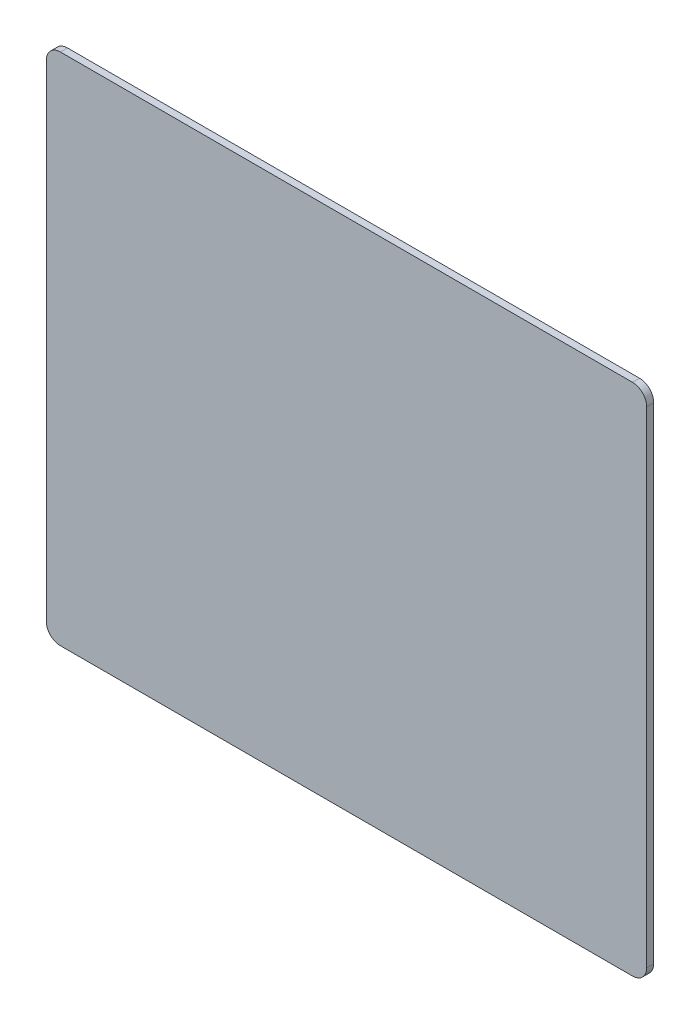
from build123d import *

# Parameters (mm, degrees)
BOSS_EXTRU_1_DEPTH              = 1
BOSS_EXTRU_2_DEPTH              = 0.2
R_P_TITION_LIN_AIRE1_COUNT      = 4
R_P_TITION_LIN_AIRE1_PITCH      = 19
R_P_TITION_LIN_AIRE1_COUNT_DIR2 = 5
R_P_TITION_LIN_AIRE1_PITCH_DIR2 = 12
ESQUISSE3_RX                    = 7.5
ESQUISSE3_RY                    = 5
BOSS_EXTRU_3_DEPTH              = 0.2
R_P_TITION_LIN_AIRE2_COUNT      = 2
R_P_TITION_LIN_AIRE2_PITCH      = 12
BOSS_EXTRU_4_DEPTH              = 0.2


with BuildPart() as part:
    # Esquisse1 → Boss.-Extru.1 (new body)
    with BuildSketch(Plane.XY):
        with BuildLine():
            Line((-40.5, 36.4), (40.5, 36.4))
            ThreePointArc((40.5, 36.4), (41.914213562, 35.814213562), (42.5, 34.4))
            Line((42.5, 34.4), (42.5, -34.4))
            ThreePointArc((42.5, -34.4), (41.914213562, -35.814213562), (40.5, -36.4))
            Line((40.5, -36.4), (-40.5, -36.4))
            ThreePointArc((-40.5, -36.4), (-41.914213562, -35.814213562), (-42.5, -34.4))
            Line((-42.5, -34.4), (-42.5, 34.4))
            ThreePointArc((-42.5, 34.4), (-41.914213562, 35.814213562), (-40.5, 36.4))
        make_face()
    extrude(amount=BOSS_EXTRU_1_DEPTH)

    # Esquisse2 → Boss.-Extru.2 (add)
    with BuildSketch(Plane(origin=(0, 0, 0), x_dir=(-1, 0, 0), z_dir=(0, 0, -1))):
        Polygon((-35.5, 28.4), (-35.5, 19.4), (-31.627016654, 18.4), (-20.5, 18.4), (-20.5, 28.4), align=None)
    boss_extru_2 = extrude(amount=BOSS_EXTRU_2_DEPTH)

    # Répétition linéaire1: Boss.-Extru.2 4 × 5, 2 skipped
    with Locations(*[(-i * R_P_TITION_LIN_AIRE1_PITCH, -j * R_P_TITION_LIN_AIRE1_PITCH_DIR2, 0) for i in range(R_P_TITION_LIN_AIRE1_COUNT) for j in range(R_P_TITION_LIN_AIRE1_COUNT_DIR2) if (i, j) not in ((0, 0), (3, 3), (3, 4))]):
        add(boss_extru_2)

    # Esquisse3 → Boss.-Extru.3 (add)
    with BuildSketch(Plane(origin=(0, 0, 0), x_dir=(-1, 0, 0), z_dir=(0, 0, -1))):
        with Locations(Location((29, -12.6), (0, 0, 0))):
            Ellipse(ESQUISSE3_RX, ESQUISSE3_RY)
    boss_extru_3 = extrude(amount=BOSS_EXTRU_3_DEPTH)

    # Répétition linéaire2: Boss.-Extru.3 ×2
    with Locations(*[(0, -i * R_P_TITION_LIN_AIRE2_PITCH, 0) for i in range(1, R_P_TITION_LIN_AIRE2_COUNT)]):
        add(boss_extru_3)

    # Esquisse4 → Boss.-Extru.4 (add)
    # profile 1 of 26: a face of its own
    with BuildSketch(Plane(origin=(0, 0, -0.2), x_dir=(-1, 0, 0), z_dir=(0, 0, -1))):
        Polygon((28, 8.4), (28, 12.4), (26.5, 12.4), (29, 15.4), (31.5, 12.4), (30, 12.4), (30, 8.4), align=None)
    # profile 2 of 26: a face of its own
    with BuildSketch(Plane(origin=(0, 0, -0.2), x_dir=(-1, 0, 0), z_dir=(0, 0, -1))):
        Polygon((28, 3.4), (28, -0.6), (26.5, -0.6), (29, -3.6), (31.5, -0.6), (30, -0.6), (30, 3.4), align=None)
    # profile 3 of 26: a face of its own
    with BuildSketch(Plane(origin=(0, 0, -0.2), x_dir=(-1, 0, 0), z_dir=(0, 0, -1))):
        Polygon((-24, -23.6), (-24, -25.6), (-28, -25.6), (-28, -27.1), (-31, -24.6), (-28, -22.1), (-28, -23.6), align=None)
    # profile 4 of 26: a face of its own
    with BuildSketch(Plane(origin=(0, 0, -0.2), x_dir=(-1, 0, 0), z_dir=(0, 0, -1))):
        Polygon((6, -23.6), (6, -25.6), (10, -25.6), (10, -27.1), (13, -24.6), (10, -22.1), (10, -23.6), align=None)
    # profile 5 of 26: a face of its own
    with BuildSketch(Plane(origin=(0, 0, -0.2), x_dir=(-1, 0, 0), z_dir=(0, 0, -1))):
        Polygon((-31.078365385, 26.220833333), (-28.242574786, 26.220833333), (-28.242574786, 25.176068376), (-30.033600427, 25.176068376), (-30.033600427, 24.05667735), (-28.242574786, 24.05667735), (-28.242574786, 23.011912393), (-30.033600427, 23.011912393), (-30.033600427, 20.4), (-31.078365385, 20.4), align=None)
    # profile 6 of 26: a face of its own
    with BuildSketch(Plane(origin=(0, 0, -0.2), x_dir=(-1, 0, 0), z_dir=(0, 0, -1))):
        Polygon((-26.573982539, 26.220833333), (-24.959027778, 26.220833333), (-24.959027778, 20.4), (-26.003792735, 20.4), (-26.003792735, 25.250694444), (-27.197809829, 25.250694444), align=None)
    # profile 7 of 26: a face of its own
    with BuildSketch(Plane(origin=(0, 0, -0.2), x_dir=(-1, 0, 0), z_dir=(0, 0, -1))):
        Polygon((-12.078365385, 26.220833333), (-9.242574786, 26.220833333), (-9.242574786, 25.176068376), (-11.033600427, 25.176068376), (-11.033600427, 24.05667735), (-9.242574786, 24.05667735), (-9.242574786, 23.011912393), (-11.033600427, 23.011912393), (-11.033600427, 20.4), (-12.078365385, 20.4), align=None)
    # profile 8 of 26: a face of its own
    with BuildSketch(Plane(origin=(0, 0, -0.2), x_dir=(-1, 0, 0), z_dir=(0, 0, -1))):
        with BuildLine():
            Line((-7.526175214, 24.280555556), (-8.570940171, 24.280555556))
            add(Edge.make_bspline(
                [(-8.570940171, 24.280555556), (-8.566427991, 24.359586497), (-8.557611463, 24.514008213), (-8.522541543, 24.738310698), (-8.475549053, 24.950251882), (-8.412831338, 25.149090371), (-8.334022424, 25.334753913), (-8.241150269, 25.507875444), (-8.1318422, 25.667543478), (-8.008424653, 25.812988004), (-7.872992917, 25.94346763), (-7.728358688, 26.059159063), (-7.572309592, 26.154624723), (-7.407696772, 26.233184122), (-7.234548259, 26.295949432), (-7.051225796, 26.33791312), (-6.859316689, 26.366331341), (-6.727939364, 26.36881805), (-6.660979233, 26.37008547)],
                knots=[0, 0, 0, 0, 1.199038563, 2.342849363, 3.436047546, 4.486744587, 5.497670872, 6.488682221, 7.459191391, 8.424610317, 9.374430501, 10.305433194, 11.225809216, 12.140057399, 13.06607119, 14.010487599, 14.985989317, 16, 16, 16, 16], degree=3))
            add(Edge.make_bspline(
                [(-6.660979233, 26.37008547), (-6.578786623, 26.367520844), (-6.418327385, 26.362514093), (-6.185167385, 26.319804843), (-5.967421439, 26.248367023), (-5.765247826, 26.148549549), (-5.580367686, 26.021741912), (-5.412811677, 25.870544558), (-5.267646961, 25.691785287), (-5.143953151, 25.492901982), (-5.041178377, 25.282312552), (-4.969158097, 25.064554348), (-4.921819942, 24.845405791), (-4.916771035, 24.697842245), (-4.914262821, 24.624535089)],
                knots=[0, 0, 0, 0, 1.075374347, 2.099382735, 3.09057751, 4.06680945, 5.040638231, 6.016817125, 7.011024321, 8.044445721, 9.0776792, 10.070479129, 11.0414456, 12, 12, 12, 12], degree=3))
            add(Edge.make_bspline(
                [(-4.914262821, 24.624535089), (-4.915239387, 24.580193741), (-4.917204973, 24.490945559), (-4.930871959, 24.355891155), (-4.951375137, 24.218322454), (-4.982288934, 24.07835741), (-5.020840973, 23.935956787), (-5.067610168, 23.79069443), (-5.123681377, 23.643393922), (-5.188118886, 23.492397423), (-5.264992997, 23.337214704), (-5.354502214, 23.175519518), (-5.459022315, 23.007455299), (-5.577290827, 22.832073104), (-5.709882154, 22.649649537), (-5.857443561, 22.460734114), (-6.018275489, 22.264661158), (-6.132422433, 22.13359739), (-6.191068209, 22.066260183)],
                knots=[0, 0, 0, 0, 0.728284026, 1.46585585, 2.227944881, 3.01186502, 3.81876927, 4.650621989, 5.517437689, 6.406905708, 7.346299482, 8.360816762, 9.441613733, 10.596154504, 11.834900912, 13.145207542, 14.533280747, 16, 16, 16, 16], degree=3))
            Line((-6.191068209, 22.066260183), (-6.798571047, 21.370138889))
            Line((-6.798571047, 21.370138889), (-4.839636752, 21.370138889))
            Line((-4.839636752, 21.370138889), (-4.839636752, 20.4))
            Line((-4.839636752, 20.4), (-8.720192308, 20.4))
            Line((-8.720192308, 20.4), (-8.720192308, 20.929378673))
            Line((-8.720192308, 20.929378673), (-6.996796541, 22.763547509))
            add(Edge.make_bspline(
                [(-6.996796541, 22.763547509), (-6.946899805, 22.817050784), (-6.850264624, 22.92067076), (-6.71276272, 23.072847719), (-6.588335644, 23.21726002), (-6.479563491, 23.355445364), (-6.380738039, 23.48292158), (-6.296265908, 23.60353096), (-6.225374243, 23.716183153), (-6.148411286, 23.852022022), (-6.075321776, 24.014034047), (-6.008257728, 24.200678542), (-5.967377549, 24.379067694), (-5.961734791, 24.4953099), (-5.959027778, 24.551075053)],
                knots=[0, 0, 0, 0, 1.246127091, 2.413378631, 3.493388633, 4.492180848, 5.408488754, 6.240484944, 6.999099869, 7.674939598, 8.898438119, 10.020720584, 11.050475521, 12, 12, 12, 12], degree=3))
            add(Edge.make_bspline(
                [(-5.959027778, 24.551075053), (-5.961051746, 24.605023537), (-5.96497351, 24.709557373), (-6.008070517, 24.858256199), (-6.074837894, 24.992887806), (-6.168922558, 25.109429251), (-6.282888553, 25.205199084), (-6.414586965, 25.276429995), (-6.562944066, 25.317529904), (-6.66694522, 25.322674144), (-6.720446882, 25.325320513)],
                knots=[0, 0, 0, 0, 1.062038974, 2.057870785, 3.028805853, 4.01125022, 4.991535629, 5.949134679, 6.94496649, 8, 8, 8, 8], degree=3))
            add(Edge.make_bspline(
                [(-6.720446882, 25.325320513), (-6.748086522, 25.324342913), (-6.802499592, 25.322418349), (-6.882482551, 25.309607053), (-6.958592084, 25.28702848), (-7.031675331, 25.25677637), (-7.100952328, 25.216676981), (-7.166248338, 25.167248095), (-7.228251335, 25.109745813), (-7.28667695, 25.044349937), (-7.339851887, 24.97136812), (-7.387081671, 24.891466902), (-7.42613284, 24.80469588), (-7.460514909, 24.712200564), (-7.487032006, 24.612987478), (-7.506339741, 24.507650403), (-7.521018124, 24.396360707), (-7.524424911, 24.319859506), (-7.526175214, 24.280555556)],
                knots=[0, 0, 0, 0, 0.903469896, 1.778625579, 2.63899355, 3.493148037, 4.358286772, 5.247621495, 6.164656832, 7.118446693, 8.109501108, 9.111810964, 10.146451449, 11.215617525, 12.33435995, 13.498009769, 14.714554818, 16, 16, 16, 16], degree=3))
        make_face()
    # profile 9 of 26: a face of its own
    with BuildSketch(Plane(origin=(0, 0, -0.2), x_dir=(-1, 0, 0), z_dir=(0, 0, -1))):
        Polygon((11.328311966, 23.086538462), (11.328311966, 22.265651709), (10.421138822, 22.265651709), (10.141291066, 20.4), (9.388034188, 20.4), (9.667881944, 22.265651709), (8.921621261, 22.265651709), (8.641773504, 20.4), (7.888516627, 20.4), (8.168364383, 22.265651709), (7.223878205, 22.265651709), (7.223878205, 23.086538462), (8.291963809, 23.086538462), (8.399238782, 23.758173077), (7.44775641, 23.758173077), (7.44775641, 24.579059829), (8.515842014, 24.579059829), (8.784029447, 26.37008547), (9.537286325, 26.37008547), (9.267932859, 24.579059829), (10.015359575, 24.579059829), (10.283547009, 26.37008547), (11.035637854, 26.37008547), (10.767450421, 24.579059829), (11.552190171, 24.579059829), (11.552190171, 23.758173077), (10.643850995, 23.758173077), (10.540074119, 23.086538462), align=None)
        Polygon((9.89176015, 23.758173077), (9.145499466, 23.758173077), (9.045220686, 23.086538462), (9.79148137, 23.086538462), align=None, mode=Mode.SUBTRACT)
    # profile 10 of 26: a face of its own
    with BuildSketch(Plane(origin=(0, 0, -0.2), x_dir=(-1, 0, 0), z_dir=(0, 0, -1))):
        Polygon((28.343269231, 24.87008547), (29.31340812, 24.87008547), (29.070873397, 23.750694444), (29.974548444, 24.542430389), (30.432799145, 23.750694444), (29.238782051, 23.414877137), (30.432799145, 23.079059829), (29.916246828, 22.2698334), (29.040556557, 23.079059829), (29.31340812, 21.959668803), (28.343269231, 21.959668803), (28.638275407, 23.079059829), (27.742762587, 22.2698334), (27.223878205, 23.079059829), (28.417895299, 23.414877137), (27.223878205, 23.750694444), (27.742762587, 24.579743423), (28.638275407, 23.750694444), align=None)
    # profile 11 of 26: a face of its own
    with BuildSketch(Plane(origin=(0, 0, -0.2), x_dir=(-1, 0, 0), z_dir=(0, 0, -1))):
        Polygon((-28.704538094, 14.220833333), (-27.089583333, 14.220833333), (-27.089583333, 8.4), (-28.134348291, 8.4), (-28.134348291, 13.250694444), (-29.328365385, 13.250694444), align=None)
    # profile 12 of 26: a face of its own
    with BuildSketch(Plane(origin=(0, 0, -0.2), x_dir=(-1, 0, 0), z_dir=(0, 0, -1))):
        with BuildLine():
            Line((-9.656730769, 12.280555556), (-10.701495726, 12.280555556))
            add(Edge.make_bspline(
                [(-10.701495726, 12.280555556), (-10.696983547, 12.359586497), (-10.688167019, 12.514008213), (-10.653097099, 12.738310698), (-10.606104609, 12.950251882), (-10.543386893, 13.149090371), (-10.46457798, 13.334753913), (-10.371705825, 13.507875444), (-10.262397756, 13.667543478), (-10.138980208, 13.812988004), (-10.003548472, 13.94346763), (-9.858914244, 14.059159063), (-9.702865147, 14.154624723), (-9.538252328, 14.233184122), (-9.365103815, 14.295949432), (-9.181781352, 14.33791312), (-8.989872244, 14.366331341), (-8.85849492, 14.36881805), (-8.791534789, 14.37008547)],
                knots=[0, 0, 0, 0, 1.199038563, 2.342849363, 3.436047546, 4.486744587, 5.497670872, 6.488682221, 7.459191391, 8.424610317, 9.374430501, 10.305433194, 11.225809216, 12.140057399, 13.06607119, 14.010487599, 14.985989317, 16, 16, 16, 16], degree=3))
            add(Edge.make_bspline(
                [(-8.791534789, 14.37008547), (-8.709342178, 14.367520844), (-8.548882941, 14.362514093), (-8.315722941, 14.319804843), (-8.097976994, 14.248367023), (-7.895803381, 14.148549549), (-7.710923241, 14.021741912), (-7.543367233, 13.870544558), (-7.398202517, 13.691785287), (-7.274508706, 13.492901982), (-7.171733933, 13.282312552), (-7.099713653, 13.064554348), (-7.052375498, 12.845405791), (-7.047326591, 12.697842245), (-7.044818376, 12.624535089)],
                knots=[0, 0, 0, 0, 1.075374347, 2.099382735, 3.09057751, 4.06680945, 5.040638231, 6.016817125, 7.011024321, 8.044445721, 9.0776792, 10.070479129, 11.0414456, 12, 12, 12, 12], degree=3))
            add(Edge.make_bspline(
                [(-7.044818376, 12.624535089), (-7.045794942, 12.580193741), (-7.047760529, 12.490945559), (-7.061427514, 12.355891155), (-7.081930693, 12.218322454), (-7.11284449, 12.07835741), (-7.151396528, 11.935956787), (-7.198165724, 11.79069443), (-7.254236933, 11.643393922), (-7.318674442, 11.492397423), (-7.395548553, 11.337214704), (-7.48505777, 11.175519518), (-7.58957787, 11.007455299), (-7.707846383, 10.832073104), (-7.840437709, 10.649649537), (-7.987999117, 10.460734114), (-8.148831045, 10.264661158), (-8.262977988, 10.13359739), (-8.321623765, 10.066260183)],
                knots=[0, 0, 0, 0, 0.728284026, 1.46585585, 2.227944881, 3.01186502, 3.81876927, 4.650621989, 5.517437689, 6.406905708, 7.346299482, 8.360816762, 9.441613733, 10.596154504, 11.834900912, 13.145207542, 14.533280747, 16, 16, 16, 16], degree=3))
            Line((-8.321623765, 10.066260183), (-8.929126603, 9.370138889))
            Line((-8.929126603, 9.370138889), (-6.970192308, 9.370138889))
            Line((-6.970192308, 9.370138889), (-6.970192308, 8.4))
            Line((-6.970192308, 8.4), (-10.850747863, 8.4))
            Line((-10.850747863, 8.4), (-10.850747863, 8.929378673))
            Line((-10.850747863, 8.929378673), (-9.127352097, 10.763547509))
            add(Edge.make_bspline(
                [(-9.127352097, 10.763547509), (-9.077455361, 10.817050784), (-8.98082018, 10.92067076), (-8.843318276, 11.072847719), (-8.718891199, 11.21726002), (-8.610119047, 11.355445364), (-8.511293595, 11.48292158), (-8.426821464, 11.60353096), (-8.355929799, 11.716183153), (-8.278966842, 11.852022022), (-8.205877332, 12.014034047), (-8.138813283, 12.200678542), (-8.097933104, 12.379067694), (-8.092290347, 12.4953099), (-8.089583333, 12.551075053)],
                knots=[0, 0, 0, 0, 1.246127091, 2.413378631, 3.493388633, 4.492180848, 5.408488754, 6.240484944, 6.999099869, 7.674939598, 8.898438119, 10.020720584, 11.050475521, 12, 12, 12, 12], degree=3))
            add(Edge.make_bspline(
                [(-8.089583333, 12.551075053), (-8.091607302, 12.605023537), (-8.095529066, 12.709557373), (-8.138626072, 12.858256199), (-8.205393449, 12.992887806), (-8.299478113, 13.109429251), (-8.413444108, 13.205199084), (-8.545142521, 13.276429995), (-8.693499621, 13.317529904), (-8.797500775, 13.322674144), (-8.851002437, 13.325320513)],
                knots=[0, 0, 0, 0, 1.062038974, 2.057870785, 3.028805853, 4.01125022, 4.991535629, 5.949134679, 6.94496649, 8, 8, 8, 8], degree=3))
            add(Edge.make_bspline(
                [(-8.851002437, 13.325320513), (-8.878642077, 13.324342913), (-8.933055147, 13.322418349), (-9.013038107, 13.309607053), (-9.08914764, 13.28702848), (-9.162230886, 13.25677637), (-9.231507884, 13.216676981), (-9.296803893, 13.167248095), (-9.358806891, 13.109745813), (-9.417232506, 13.044349937), (-9.470407442, 12.97136812), (-9.517637227, 12.891466902), (-9.556688396, 12.80469588), (-9.591070465, 12.712200564), (-9.617587561, 12.612987478), (-9.636895297, 12.507650403), (-9.651573679, 12.396360707), (-9.654980467, 12.319859506), (-9.656730769, 12.280555556)],
                knots=[0, 0, 0, 0, 0.903469896, 1.778625579, 2.63899355, 3.493148037, 4.358286772, 5.247621495, 6.164656832, 7.118446693, 8.109501108, 9.111810964, 10.146451449, 11.215617525, 12.33435995, 13.498009769, 14.714554818, 16, 16, 16, 16], degree=3))
        make_face()
    # profile 13 of 26: a face of its own
    with BuildSketch(Plane(origin=(0, 0, -0.2), x_dir=(-1, 0, 0), z_dir=(0, 0, -1))):
        with BuildLine():
            Line((9.567147436, 12.802938034), (8.522382479, 12.802938034))
            add(Edge.make_bspline(
                [(8.522382479, 12.802938034), (8.529758917, 12.855162107), (8.544219934, 12.957543943), (8.578823216, 13.105767337), (8.620212476, 13.24636737), (8.671884851, 13.37889879), (8.732488142, 13.503597681), (8.801406079, 13.620891947), (8.879383691, 13.73027814), (8.939154357, 13.796172817), (8.968972857, 13.829046474)],
                knots=[0, 0, 0, 0, 1.111473889, 2.178970933, 3.205615836, 4.199322666, 5.174200091, 6.12565194, 7.064921805, 8, 8, 8, 8], degree=3))
            add(Edge.make_bspline(
                [(8.968972857, 13.829046474), (9.011982091, 13.872420883), (9.096748771, 13.957907284), (9.238403837, 14.067405921), (9.386884505, 14.162169544), (9.545168622, 14.23729883), (9.710793168, 14.298107284), (9.885075245, 14.33895246), (10.067302675, 14.366053594), (10.191649971, 14.36872315), (10.255106504, 14.37008547)],
                knots=[0, 0, 0, 0, 1.01925491, 2.00884431, 2.983262333, 3.955970413, 4.92937149, 5.924503185, 6.940838805, 8, 8, 8, 8], degree=3))
            add(Edge.make_bspline(
                [(10.255106504, 14.37008547), (10.311522626, 14.368753596), (10.422425355, 14.3661354), (10.58542446, 14.345117942), (10.740830466, 14.308255662), (10.89028606, 14.260059058), (11.031593237, 14.194479524), (11.167870783, 14.118355642), (11.295311099, 14.024986538), (11.41421237, 13.919488847), (11.523445866, 13.805382766), (11.618042551, 13.68341275), (11.699369019, 13.556836898), (11.766371272, 13.424603605), (11.817886899, 13.286489116), (11.853640272, 13.1432913), (11.877041723, 12.995326133), (11.879373119, 12.894756203), (11.880555556, 12.843749165)],
                knots=[0, 0, 0, 0, 1.091422571, 2.145516843, 3.172569842, 4.178562979, 5.178154469, 6.181868002, 7.194278174, 8.227918432, 9.254613415, 10.245994977, 11.209837596, 12.161663635, 13.10878368, 14.055455738, 15.013766427, 16, 16, 16, 16], degree=3))
            add(Edge.make_bspline(
                [(11.880555556, 12.843749165), (11.878129124, 12.780581197), (11.873352227, 12.656222888), (11.834154327, 12.474215263), (11.772798955, 12.300183492), (11.684165153, 12.136562544), (11.573350325, 11.9837977), (11.437384242, 11.846996349), (11.280139572, 11.724013632), (11.162093903, 11.657922704), (11.101645967, 11.62407936)],
                knots=[0, 0, 0, 0, 0.992805628, 1.954529043, 2.915727527, 3.886831945, 4.871318353, 5.87440735, 6.911542536, 8, 8, 8, 8], degree=3))
            add(Edge.make_bspline(
                [(11.101645967, 11.62407936), (11.143136503, 11.610457144), (11.224663546, 11.583690099), (11.340544434, 11.530972707), (11.450733917, 11.473361337), (11.553334573, 11.406432111), (11.649366887, 11.332891351), (11.738245436, 11.252110404), (11.820501249, 11.16426541), (11.894791533, 11.068873255), (11.960727063, 10.967459551), (12.019887502, 10.862366895), (12.068579842, 10.752001536), (12.109828316, 10.637623923), (12.141232555, 10.518206089), (12.163343946, 10.394210769), (12.176124872, 10.265920803), (12.178074182, 10.17900443), (12.179059829, 10.13505609)],
                knots=[0, 0, 0, 0, 1.059543567, 2.081955587, 3.086750234, 4.076226789, 5.052108497, 6.020845489, 6.989030705, 7.970690546, 8.952259656, 9.923888338, 10.895517021, 11.877585046, 12.873342345, 13.889638361, 14.932918083, 16, 16, 16, 16], degree=3))
            add(Edge.make_bspline(
                [(12.179059829, 10.13505609), (12.177061789, 10.070469874), (12.173122061, 9.943119009), (12.148075116, 9.755544218), (12.101442216, 9.57670832), (12.040094053, 9.404553539), (11.958262262, 9.241302329), (11.861960002, 9.083208298), (11.743585175, 8.935754103), (11.61203188, 8.795041439), (11.465934276, 8.667111784), (11.307540707, 8.556202531), (11.140334109, 8.461022658), (10.963256615, 8.383752926), (10.776369746, 8.324246395), (10.580090056, 8.281232331), (10.37359283, 8.254915615), (10.232642318, 8.252156807), (10.160657886, 8.250747863)],
                knots=[0, 0, 0, 0, 1.005138573, 1.981928558, 2.936866704, 3.876260664, 4.820238198, 5.773547, 6.751179199, 7.756627054, 8.768222608, 9.766606018, 10.760583154, 11.757261445, 12.767156078, 13.807575856, 14.880313354, 16, 16, 16, 16], degree=3))
            add(Edge.make_bspline(
                [(10.160657886, 8.250747863), (10.092561774, 8.252233356), (9.959408839, 8.25513804), (9.764644804, 8.280279551), (9.579540024, 8.32083485), (9.403622109, 8.378000906), (9.237571671, 8.452135512), (9.079882901, 8.540413193), (8.933702443, 8.647925601), (8.797401558, 8.769819422), (8.674003813, 8.906577369), (8.563715288, 9.055031511), (8.468967865, 9.215746359), (8.389372983, 9.388035271), (8.325552895, 9.572200495), (8.275211796, 9.76786752), (8.240047715, 9.97541862), (8.22933842, 10.118218193), (8.223878205, 10.191025641)],
                knots=[0, 0, 0, 0, 1.066544725, 2.085487077, 3.070979577, 4.031932826, 4.977951092, 5.916076795, 6.857635327, 7.814973522, 8.776389752, 9.738577119, 10.707772778, 11.69409279, 12.707140348, 13.757286496, 14.856535458, 16, 16, 16, 16], degree=3))
            Line((8.223878205, 10.191025641), (9.268643162, 10.191025641))
            add(Edge.make_bspline(
                [(9.268643162, 10.191025641), (9.275263729, 10.1544171), (9.288159019, 10.083112367), (9.31331049, 9.979878964), (9.346086367, 9.884588156), (9.383983435, 9.796393003), (9.424917973, 9.714135532), (9.474376685, 9.640853715), (9.528735495, 9.57455765), (9.607175654, 9.495744157), (9.719311264, 9.414766583), (9.870731487, 9.34439322), (10.039172147, 9.303145782), (10.156928966, 9.298113722), (10.21779347, 9.295512821)],
                knots=[0, 0, 0, 0, 0.928156231, 1.807827665, 2.648129825, 3.438902246, 4.202261636, 4.936546065, 5.639352463, 6.338805438, 7.70633318, 9.064371875, 10.482673459, 12, 12, 12, 12], degree=3))
            add(Edge.make_bspline(
                [(10.21779347, 9.295512821), (10.250090326, 9.296066658), (10.313352644, 9.297151502), (10.406275567, 9.309175541), (10.494797736, 9.328979143), (10.579084027, 9.355891504), (10.659671011, 9.389627831), (10.735018994, 9.433128806), (10.806663756, 9.483704899), (10.873826453, 9.540565855), (10.935886169, 9.602523942), (10.987523502, 9.671131997), (11.034716288, 9.740850043), (11.069620413, 9.816239281), (11.100203946, 9.893242964), (11.11892263, 9.974656085), (11.133056581, 10.058770815), (11.13387799, 10.116335243), (11.134294872, 10.145550381)],
                knots=[0, 0, 0, 0, 1.110435564, 2.175094844, 3.216326037, 4.226890168, 5.215276772, 6.21526065, 7.213097102, 8.228249917, 9.239874822, 10.221364777, 11.178138315, 12.128914389, 13.072518965, 14.022636769, 14.996447288, 16, 16, 16, 16], degree=3))
            add(Edge.make_bspline(
                [(11.134294872, 10.145550381), (11.133188129, 10.177502111), (11.130984857, 10.241110684), (11.112983894, 10.333934023), (11.084556569, 10.423222593), (11.045067542, 10.508580983), (10.992334347, 10.58969458), (10.930109766, 10.668190767), (10.85349153, 10.739983958), (10.769431065, 10.810949351), (10.671953948, 10.872809771), (10.565807452, 10.92989785), (10.448201882, 10.975322336), (10.322008096, 11.015894815), (10.184839019, 11.045528324), (10.037546422, 11.06704514), (9.880367909, 11.083061074), (9.772022717, 11.085358824), (9.716399573, 11.086538462)],
                knots=[0, 0, 0, 0, 0.809814727, 1.612155564, 2.388397, 3.182215007, 3.988903953, 4.837162975, 5.715530372, 6.646997145, 7.623086902, 8.637258368, 9.698941581, 10.815059213, 11.996518529, 13.252603015, 14.589518788, 16, 16, 16, 16], degree=3))
            Line((9.716399573, 11.086538462), (9.716399573, 12.05667735))
            add(Edge.make_bspline(
                [(9.716399573, 12.05667735), (9.785653695, 12.062575253), (9.915214443, 12.073609061), (10.095051708, 12.099412004), (10.246451503, 12.133901886), (10.373052725, 12.175512062), (10.478174267, 12.228950368), (10.570007867, 12.287943898), (10.649099306, 12.356456262), (10.715942183, 12.43244443), (10.769414404, 12.514048596), (10.807258927, 12.600000391), (10.832249473, 12.68764036), (10.834617325, 12.747583457), (10.835790598, 12.777285323)],
                knots=[0, 0, 0, 0, 1.70044513, 3.18119609, 4.440695891, 5.496282586, 6.431922213, 7.318171381, 8.16090191, 8.983045123, 9.787564368, 10.536848927, 11.275007137, 12, 12, 12, 12], degree=3))
            add(Edge.make_bspline(
                [(10.835790598, 12.777285323), (10.833766366, 12.81518168), (10.829815493, 12.889147344), (10.799130875, 12.995007792), (10.745865855, 13.089373607), (10.674446816, 13.172046217), (10.587420233, 13.241100577), (10.485409823, 13.291232865), (10.370629216, 13.320687823), (10.289874874, 13.323741309), (10.24811031, 13.325320513)],
                knots=[0, 0, 0, 0, 1.009664648, 1.970651636, 2.907870547, 3.878035693, 4.867062054, 5.849714035, 6.887914197, 8, 8, 8, 8], degree=3))
            add(Edge.make_bspline(
                [(10.24811031, 13.325320513), (10.210255428, 13.323457219), (10.135139748, 13.319759873), (10.02529814, 13.292163861), (9.920985209, 13.245709409), (9.824360979, 13.181651457), (9.736820242, 13.104720573), (9.664974554, 13.013611909), (9.605216717, 12.913783943), (9.579886944, 12.840031519), (9.567147436, 12.802938034)],
                knots=[0, 0, 0, 0, 0.98818071, 1.960853194, 2.938124878, 3.957524365, 4.978590984, 5.968022688, 6.978025184, 8, 8, 8, 8], degree=3))
        make_face()
    # profile 14 of 26: a face of its own
    with BuildSketch(Plane(origin=(0, 0, -0.2), x_dir=(-1, 0, 0), z_dir=(0, 0, -1))):
        Polygon((-27.432396835, 2.37008547), (-26.34332265, 2.37008547), (-26.34332265, -1.435844017), (-25.820940171, -1.435844017), (-25.820940171, -2.405982906), (-26.34332265, -2.405982906), (-26.34332265, -3.6), (-27.388087607, -3.6), (-27.388087607, -2.405982906), (-29.850747863, -2.405982906), (-29.850747863, -1.348391593), align=None)
        Polygon((-27.388087607, -1.435844017), (-27.388087607, 0.545244892), (-28.676553319, -1.435844017), align=None, mode=Mode.SUBTRACT)
    # profile 15 of 26: a face of its own
    with BuildSketch(Plane(origin=(0, 0, -0.2), x_dir=(-1, 0, 0), z_dir=(0, 0, -1))):
        with BuildLine():
            Line((-9.695209836, 2.220833333), (-7.044818376, 2.220833333))
            Line((-7.044818376, 2.220833333), (-7.044818376, 1.250694444))
            Line((-7.044818376, 1.250694444), (-8.86732689, 1.250694444))
            Line((-8.86732689, 1.250694444), (-9.094703192, 0.149959936))
            add(Edge.make_bspline(
                [(-9.094703192, 0.149959936), (-9.063719916, 0.158589169), (-9.00261453, 0.175607791), (-8.91055919, 0.192675315), (-8.821344737, 0.203737941), (-8.762802757, 0.205213548), (-8.734399205, 0.205929487)],
                knots=[0, 0, 0, 0, 1.05461699, 2.079921384, 3.068411212, 4, 4, 4, 4], degree=3))
            add(Edge.make_bspline(
                [(-8.734399205, 0.205929487), (-8.672504891, 0.204511215), (-8.550497563, 0.201715488), (-8.372016324, 0.175174917), (-8.201109994, 0.133374323), (-8.038301566, 0.073758052), (-7.88375008, -0.003834065), (-7.737268191, -0.097698776), (-7.598676117, -0.208000942), (-7.470435836, -0.33480962), (-7.352603308, -0.47404842), (-7.250154646, -0.624649916), (-7.162657096, -0.784466676), (-7.093064569, -0.954492117), (-7.038136214, -1.133658367), (-6.998443758, -1.32208024), (-6.974971626, -1.519981043), (-6.971806553, -1.654994612), (-6.970192308, -1.723854)],
                knots=[0, 0, 0, 0, 1.01440847, 1.999622559, 2.951875003, 3.895578053, 4.836219714, 5.782137149, 6.743708247, 7.735272588, 8.734977101, 9.730283169, 10.717124674, 11.717316708, 12.737475749, 13.78628267, 14.87096371, 16, 16, 16, 16], degree=3))
            add(Edge.make_bspline(
                [(-6.970192308, -1.723854), (-6.972164941, -1.793495101), (-6.976057524, -1.93091735), (-7.001453058, -2.132976665), (-7.046276631, -2.326503874), (-7.107846294, -2.512017044), (-7.188960383, -2.688152697), (-7.286511178, -2.856735468), (-7.402147997, -3.016514021), (-7.534736049, -3.16585043), (-7.678876653, -3.302346776), (-7.832352371, -3.422422872), (-7.99408499, -3.523465934), (-8.164078412, -3.605125811), (-8.341357331, -3.669733652), (-8.525975552, -3.716765077), (-8.718830297, -3.743734985), (-8.849753611, -3.747392877), (-8.916300247, -3.749252137)],
                knots=[0, 0, 0, 0, 1.06808661, 2.107647099, 3.116961351, 4.110378221, 5.100014249, 6.085620622, 7.093190682, 8.119403071, 9.144090782, 10.133780668, 11.103064255, 12.062861538, 13.020824475, 13.992378307, 14.979551724, 16, 16, 16, 16], degree=3))
            add(Edge.make_bspline(
                [(-8.916300247, -3.749252137), (-8.975810923, -3.747731147), (-9.09317843, -3.744731436), (-9.266055614, -3.726293635), (-9.432728418, -3.693695429), (-9.59231199, -3.646517385), (-9.746485417, -3.588451983), (-9.893466409, -3.515830225), (-10.034062653, -3.430034926), (-10.167874908, -3.332631853), (-10.292728915, -3.222911069), (-10.406682423, -3.102802766), (-10.510425321, -2.973820852), (-10.601737673, -2.834374081), (-10.680333243, -2.684668478), (-10.750033397, -2.526468358), (-10.807083672, -2.358121607), (-10.836035043, -2.241414285), (-10.850747863, -2.182104701)],
                knots=[0, 0, 0, 0, 1.054957082, 2.080596141, 3.077793124, 4.061112343, 5.027190972, 5.994718051, 6.962465889, 7.943658696, 8.924948258, 9.904494768, 10.875059, 11.855380583, 12.854004648, 13.869083016, 14.917087635, 16, 16, 16, 16], degree=3))
            Line((-10.850747863, -2.182104701), (-9.656730769, -2.182104701))
            add(Edge.make_bspline(
                [(-9.656730769, -2.182104701), (-9.634904108, -2.223203828), (-9.592486483, -2.303075291), (-9.511798781, -2.409116659), (-9.421474023, -2.499544182), (-9.322326985, -2.575241357), (-9.213715256, -2.631952392), (-9.10006456, -2.674959417), (-8.979947151, -2.699811584), (-8.898141892, -2.702918352), (-8.856832599, -2.704487179)],
                knots=[0, 0, 0, 0, 1.104910296, 2.147267069, 3.153527244, 4.136738762, 5.099945312, 6.05603338, 7.018353, 8, 8, 8, 8], degree=3))
            add(Edge.make_bspline(
                [(-8.856832599, -2.704487179), (-8.828040576, -2.70340389), (-8.771391785, -2.7012725), (-8.68792875, -2.689996913), (-8.608259615, -2.668641207), (-8.531792062, -2.639068518), (-8.458320677, -2.602188035), (-8.388898699, -2.555628828), (-8.32231831, -2.502037454), (-8.259593135, -2.440541172), (-8.202782205, -2.371987121), (-8.152965235, -2.29832112), (-8.108421993, -2.221180044), (-8.075428133, -2.13750814), (-8.048408951, -2.049803881), (-8.028510933, -1.957405688), (-8.016619623, -1.860205646), (-8.015518806, -1.793849902), (-8.014957265, -1.760001002)],
                knots=[0, 0, 0, 0, 0.978869489, 1.925942215, 2.855067702, 3.774946051, 4.70828698, 5.642468714, 6.60995405, 7.609372294, 8.622401667, 9.629904756, 10.629323, 11.642352373, 12.678539694, 13.745912462, 14.850161547, 16, 16, 16, 16], degree=3))
            add(Edge.make_bspline(
                [(-8.014957265, -1.760001002), (-8.015608998, -1.726937811), (-8.016877612, -1.662579506), (-8.027371841, -1.568078463), (-8.046145814, -1.478414075), (-8.071725513, -1.392899581), (-8.104470582, -1.312054266), (-8.144487245, -1.235396898), (-8.191946458, -1.163314955), (-8.247103019, -1.097275952), (-8.305921408, -1.036703101), (-8.369111257, -0.983726568), (-8.43610326, -0.939759724), (-8.504815724, -0.901375389), (-8.577991401, -0.873440108), (-8.653984865, -0.85420211), (-8.732716199, -0.840086041), (-8.786417134, -0.83925667), (-8.813689403, -0.83883547)],
                knots=[0, 0, 0, 0, 1.166249705, 2.270133367, 3.348514167, 4.393962215, 5.415026464, 6.420877785, 7.440098956, 8.453121383, 9.451844239, 10.415694839, 11.355045125, 12.27538808, 13.187007209, 14.108269027, 15.039275622, 16, 16, 16, 16], degree=3))
            add(Edge.make_bspline(
                [(-8.813689403, -0.83883547), (-8.843313426, -0.839959537), (-8.902686324, -0.842212409), (-8.99089959, -0.860543424), (-9.078049248, -0.890209882), (-9.164619942, -0.931139462), (-9.249752307, -0.984703368), (-9.335693028, -1.047527689), (-9.419565483, -1.124177208), (-9.472893924, -1.181265944), (-9.500482439, -1.21079978)],
                knots=[0, 0, 0, 0, 0.88288272, 1.769486374, 2.674910571, 3.623812639, 4.617874466, 5.670434592, 6.794841017, 8, 8, 8, 8], degree=3))
            Line((-9.500482439, -1.21079978), (-10.379670807, -1.009076189))
            Line((-10.379670807, -1.009076189), (-9.695209836, 2.220833333))
        make_face()
    # profile 16 of 26: a face of its own
    with BuildSketch(Plane(origin=(0, 0, -0.2), x_dir=(-1, 0, 0), z_dir=(0, 0, -1))):
        with BuildLine():
            Line((10.290087473, 2.37008547), (11.214751102, 1.901340478))
            Line((11.214751102, 1.901340478), (10.200302985, -0.092574786))
            add(Edge.make_bspline(
                [(10.200302985, -0.092574786), (10.260235628, -0.094126473), (10.378282796, -0.097182773), (10.551965252, -0.121884307), (10.718008913, -0.164587335), (10.87808799, -0.221190084), (11.030245667, -0.297208138), (11.17693253, -0.387635579), (11.314353714, -0.497921569), (11.445660171, -0.620112596), (11.565056457, -0.755482692), (11.66877324, -0.90094216), (11.759160585, -1.052951955), (11.82942407, -1.214912903), (11.886100936, -1.384140318), (11.926995789, -1.561310674), (11.950327447, -1.746937018), (11.953544106, -1.873041403), (11.955181624, -1.937237914)],
                knots=[0, 0, 0, 0, 1.013260694, 1.995783107, 2.958651975, 3.908806537, 4.861209129, 5.829647963, 6.817170299, 7.835534541, 8.860094905, 9.863329007, 10.853101798, 11.844815043, 12.84250023, 13.867713965, 14.914507806, 16, 16, 16, 16], degree=3))
            add(Edge.make_bspline(
                [(11.955181624, -1.937237914), (11.953647134, -1.999119457), (11.950614105, -2.121432731), (11.925542104, -2.301079823), (11.885024435, -2.473440703), (11.827116549, -2.638171143), (11.753510942, -2.796076351), (11.663496272, -2.947063667), (11.556326039, -3.090004811), (11.434769228, -3.224140264), (11.301886663, -3.346405722), (11.161821202, -3.455082376), (11.013385948, -3.544853415), (10.859386501, -3.620667162), (10.696987636, -3.677240641), (10.528619661, -3.719943818), (10.353005792, -3.744585404), (10.233803597, -3.747684112), (10.173484241, -3.749252137)],
                knots=[0, 0, 0, 0, 1.049934834, 2.075270938, 3.072134561, 4.05064612, 5.033440221, 6.024524368, 7.028587226, 8.060776465, 9.092543989, 10.090062252, 11.064205434, 12.031961459, 12.998029633, 13.977230324, 14.976426867, 16, 16, 16, 16], degree=3))
            add(Edge.make_bspline(
                [(10.173484241, -3.749252137), (10.110408526, -3.747965342), (9.986378665, -3.745435033), (9.804891937, -3.717102249), (9.630830546, -3.674451193), (9.465172744, -3.61355273), (9.306888355, -3.53601009), (9.157840892, -3.440058871), (9.016774836, -3.32675716), (8.885194159, -3.198654065), (8.766649774, -3.058334652), (8.660918091, -2.912646568), (8.571468951, -2.761361196), (8.499061957, -2.60464029), (8.442568341, -2.442983248), (8.403260306, -2.276083257), (8.377647494, -2.104383019), (8.374644976, -1.987857522), (8.373130342, -1.929075688)],
                knots=[0, 0, 0, 0, 1.063775006, 2.091769615, 3.092589432, 4.084662827, 5.064601646, 6.061867366, 7.070035304, 8.113879863, 9.156342271, 10.166834137, 11.149076039, 12.117706134, 13.076241869, 14.034148791, 15.008317125, 16, 16, 16, 16], degree=3))
            add(Edge.make_bspline(
                [(8.373130342, -1.929075688), (8.373930645, -1.883556034), (8.375535706, -1.792263344), (8.391665607, -1.655557502), (8.416188724, -1.518492821), (8.444614226, -1.402833302), (8.473883937, -1.305031075), (8.503344125, -1.222263693), (8.539853538, -1.130409997), (8.581589205, -1.02923543), (8.62986356, -0.918861704), (8.684424428, -0.79958967), (8.745407641, -0.670516109), (8.78889707, -0.581862559), (8.811558494, -0.535667067)],
                knots=[0, 0, 0, 0, 1.110454016, 2.227089276, 3.35462975, 4.507227546, 5.131400587, 5.845402449, 6.650387134, 7.543487832, 8.516250726, 9.590168902, 10.744287919, 12, 12, 12, 12], degree=3))
            Line((8.811558494, -0.535667067), (10.290087473, 2.37008547))
        make_face()
        with BuildLine():
            add(Edge.make_bspline(
                [(10.150163595, -1.062713675), (10.100032593, -1.065013078), (10.001932801, -1.069512709), (9.862449569, -1.116635026), (9.735272508, -1.190558214), (9.625033858, -1.29351055), (9.532829371, -1.416542633), (9.465074279, -1.556877159), (9.424315826, -1.7126414), (9.420081283, -1.821549161), (9.417895299, -1.877770266)],
                knots=[0, 0, 0, 0, 0.981744412, 1.921144944, 2.858899012, 3.85339082, 4.86292663, 5.863643845, 6.897155691, 8, 8, 8, 8], degree=3))
            add(Edge.make_bspline(
                [(9.417895299, -1.877770266), (9.420483573, -1.934010093), (9.425517938, -2.043400316), (9.467808963, -2.20064771), (9.537052493, -2.34416907), (9.634162128, -2.468831596), (9.748167443, -2.572311144), (9.874585816, -2.648839218), (10.011308543, -2.695852926), (10.105882992, -2.701589222), (10.153661692, -2.704487179)],
                knots=[0, 0, 0, 0, 1.098279937, 2.136227893, 3.159405121, 4.194678092, 5.206500211, 6.154139736, 7.067477469, 8, 8, 8, 8], degree=3))
            add(Edge.make_bspline(
                [(10.153661692, -2.704487179), (10.2041214, -2.701537607), (10.303081651, -2.695752983), (10.445838303, -2.650717527), (10.576247362, -2.575471549), (10.691554195, -2.472323299), (10.790600573, -2.34908334), (10.859130662, -2.204718956), (10.90337682, -2.046336605), (10.908017438, -1.935218843), (10.910416667, -1.877770266)],
                knots=[0, 0, 0, 0, 0.96921794, 1.900804717, 2.848419905, 3.844199796, 4.861108892, 5.867439427, 6.897452859, 8, 8, 8, 8], degree=3))
            add(Edge.make_bspline(
                [(10.910416667, -1.877770266), (10.907683507, -1.821581987), (10.902390424, -1.712766825), (10.8626331, -1.556272865), (10.791649083, -1.41647924), (10.697358395, -1.293002693), (10.583325917, -1.190096264), (10.45105897, -1.116052045), (10.305203911, -1.069596194), (10.2025972, -1.065041297), (10.150163595, -1.062713675)],
                knots=[0, 0, 0, 0, 1.083229974, 2.097801324, 3.086792542, 4.086858909, 5.079819718, 6.026392613, 6.991456328, 8, 8, 8, 8], degree=3))
        make_face(mode=Mode.SUBTRACT)
    # profile 17 of 26: a face of its own
    with BuildSketch(Plane(origin=(0, 0, -0.2), x_dir=(-1, 0, 0), z_dir=(0, 0, -1))):
        Polygon((-29.55224359, -9.779166667), (-25.820940171, -9.779166667), (-25.820940171, -10.321371695), (-28.388543336, -15.749252137), (-29.314372997, -15.282839209), (-27.168873531, -10.749305556), (-29.55224359, -10.749305556), align=None)
    # profile 18 of 26: a face of its own
    with BuildSketch(Plane(origin=(0, 0, -0.2), x_dir=(-1, 0, 0), z_dir=(0, 0, -1))):
        with BuildLine():
            add(Edge.make_bspline(
                [(-7.618506277, -12.465705128), (-7.557467508, -12.509318978), (-7.436646771, -12.595648658), (-7.277086775, -12.750311509), (-7.13964999, -12.922839712), (-7.025779653, -13.112175015), (-6.934550174, -13.313663507), (-6.869243708, -13.525151516), (-6.827761791, -13.744773666), (-6.823230728, -13.894298551), (-6.820940171, -13.969886819)],
                knots=[0, 0, 0, 0, 1.013736912, 2.006600758, 2.994453809, 3.989973287, 4.987781207, 5.978959008, 6.978317308, 8, 8, 8, 8], degree=3))
            add(Edge.make_bspline(
                [(-6.820940171, -13.969886819), (-6.823703553, -14.051735608), (-6.829184368, -14.214072177), (-6.877642093, -14.452138729), (-6.955439025, -14.680852028), (-7.061763716, -14.897687655), (-7.195075322, -15.095907191), (-7.350462399, -15.27138797), (-7.528120822, -15.419547007), (-7.693525846, -15.520071957), (-7.835895729, -15.586848782), (-7.950786975, -15.629584609), (-8.072104579, -15.667207525), (-8.200714246, -15.697265738), (-8.336592589, -15.720731107), (-8.479545695, -15.736227592), (-8.629667665, -15.747492593), (-8.732044502, -15.748655733), (-8.784538595, -15.749252137)],
                knots=[0, 0, 0, 0, 1.313679292, 2.605514271, 3.884962679, 5.186178731, 6.472827995, 7.711026938, 8.938935107, 10.174644318, 10.808706728, 11.462743532, 12.142127587, 12.847854939, 13.582806024, 14.355735269, 15.156897313, 16, 16, 16, 16], degree=3))
            add(Edge.make_bspline(
                [(-8.784538595, -15.749252137), (-8.840518338, -15.748492796), (-8.949835738, -15.747009952), (-9.109414792, -15.738043897), (-9.259944982, -15.721513967), (-9.401742073, -15.699753594), (-9.534669639, -15.670958315), (-9.658731619, -15.634447478), (-9.774227572, -15.592875827), (-9.915600687, -15.529579422), (-10.077164519, -15.43072853), (-10.251785805, -15.285964249), (-10.405058617, -15.113545467), (-10.538314811, -14.918311955), (-10.643352367, -14.701464787), (-10.721461423, -14.469810092), (-10.767718532, -14.223975623), (-10.77328737, -14.055591099), (-10.776121795, -13.969886819)],
                knots=[0, 0, 0, 0, 0.886964665, 1.7320671, 2.531131818, 3.285397207, 4.004107883, 4.684213108, 5.332925796, 5.947568694, 7.135706876, 8.320776993, 9.52873045, 10.778999824, 12.05415135, 13.333578234, 14.642845846, 16, 16, 16, 16], degree=3))
            add(Edge.make_bspline(
                [(-10.776121795, -13.969886819), (-10.773531606, -13.895123934), (-10.76844157, -13.748205813), (-10.731980955, -13.5329243), (-10.669462082, -13.328811953), (-10.583676456, -13.134447825), (-10.473057348, -12.949810289), (-10.336950621, -12.776257916), (-10.17708197, -12.612225018), (-10.055850585, -12.515355212), (-9.993714109, -12.465705128)],
                knots=[0, 0, 0, 0, 1.01821053, 2.000906977, 2.963938143, 3.919209931, 4.888045165, 5.887808425, 6.917407893, 8, 8, 8, 8], degree=3))
            add(Edge.make_bspline(
                [(-9.993714109, -12.465705128), (-10.032235428, -12.421276422), (-10.108072305, -12.333809681), (-10.206205968, -12.193038931), (-10.288879448, -12.047904141), (-10.359073168, -11.899583155), (-10.410962156, -11.745522257), (-10.450202192, -11.588143598), (-10.472396319, -11.425843851), (-10.475865328, -11.316448998), (-10.477617521, -11.261193743)],
                knots=[0, 0, 0, 0, 1.061529281, 2.089831458, 3.092927091, 4.075998741, 5.048384512, 6.024008542, 7.00192825, 8, 8, 8, 8], degree=3))
            add(Edge.make_bspline(
                [(-10.477617521, -11.261193743), (-10.475294379, -11.186394418), (-10.470710909, -11.038818229), (-10.430115378, -10.823026999), (-10.362716939, -10.617982321), (-10.271027099, -10.424284535), (-10.154595253, -10.246155078), (-10.016249012, -10.086412774), (-9.854043501, -9.950908923), (-9.674010707, -9.834640638), (-9.47524822, -9.742161923), (-9.259641879, -9.677452244), (-9.029795162, -9.636487605), (-8.871391665, -9.632138886), (-8.790368757, -9.62991453)],
                knots=[0, 0, 0, 0, 1.022455555, 2.017265428, 2.990720743, 3.968117071, 4.939886797, 5.893155559, 6.847550415, 7.820889576, 8.817530429, 9.83499769, 10.892607882, 12, 12, 12, 12], degree=3))
            add(Edge.make_bspline(
                [(-8.790368757, -9.62991453), (-8.71051279, -9.632142527), (-8.554810375, -9.636486654), (-8.329002906, -9.67717986), (-8.11805586, -9.743330959), (-7.923713614, -9.837762313), (-7.745542709, -9.954254692), (-7.586094004, -10.094476661), (-7.448181898, -10.258197605), (-7.330783593, -10.44093522), (-7.237235184, -10.637808522), (-7.168075176, -10.844271051), (-7.12807221, -11.058699991), (-7.122331867, -11.204287124), (-7.119444444, -11.277518196)],
                knots=[0, 0, 0, 0, 1.094655142, 2.134348324, 3.136019022, 4.118575226, 5.088726318, 6.048298823, 7.020513804, 8.015920439, 9.020015034, 10.003048569, 10.995523219, 12, 12, 12, 12], degree=3))
            add(Edge.make_bspline(
                [(-7.119444444, -11.277518196), (-7.120835385, -11.329273957), (-7.123565002, -11.43084077), (-7.14374724, -11.580477349), (-7.177731651, -11.724053847), (-7.225113614, -11.865039919), (-7.290990719, -12.007266941), (-7.380137757, -12.153460243), (-7.488573424, -12.309694182), (-7.573733371, -12.411946104), (-7.618506277, -12.465705128)],
                knots=[0, 0, 0, 0, 0.940746401, 1.846144481, 2.739104268, 3.619506754, 4.545839139, 5.581956076, 6.728711598, 8, 8, 8, 8], degree=3))
        make_face()
        with BuildLine():
            add(Edge.make_bspline(
                [(-8.816021468, -10.674679487), (-8.859036623, -10.676753216), (-8.942710603, -10.680787076), (-9.062103575, -10.717197132), (-9.169441752, -10.776748367), (-9.262274929, -10.858702587), (-9.338402973, -10.958141755), (-9.394352903, -11.0724674), (-9.427531873, -11.200268613), (-9.431044512, -11.289757445), (-9.432852564, -11.335819812)],
                knots=[0, 0, 0, 0, 1.018099191, 1.980427864, 2.929421084, 3.909248076, 4.895556904, 5.880788387, 6.909183412, 8, 8, 8, 8], degree=3))
            add(Edge.make_bspline(
                [(-9.432852564, -11.335819812), (-9.430619067, -11.38227556), (-9.426257949, -11.472984887), (-9.39196265, -11.603241577), (-9.333505367, -11.721291181), (-9.253243912, -11.82466803), (-9.155713247, -11.909103251), (-9.046508801, -11.973590172), (-8.924419476, -12.010404084), (-8.839579111, -12.015396181), (-8.796198918, -12.017948718)],
                knots=[0, 0, 0, 0, 1.07118507, 2.091592095, 3.082435519, 4.092579768, 5.090825648, 6.043203473, 6.999459622, 8, 8, 8, 8], degree=3))
            add(Edge.make_bspline(
                [(-8.796198918, -12.017948718), (-8.7519986, -12.01597094), (-8.665888088, -12.012117857), (-8.543493922, -11.974348727), (-8.43323242, -11.913944701), (-8.338809734, -11.828546773), (-8.260598744, -11.725132485), (-8.203639486, -11.605019861), (-8.170855794, -11.470465661), (-8.166479056, -11.376424627), (-8.164209402, -11.327657585)],
                knots=[0, 0, 0, 0, 1.008803858, 1.965339183, 2.900766489, 3.864508618, 4.855158575, 5.849593072, 6.884859315, 8, 8, 8, 8], degree=3))
            add(Edge.make_bspline(
                [(-8.164209402, -11.327657585), (-8.166536469, -11.281625669), (-8.171036934, -11.192601561), (-8.203306994, -11.064792057), (-8.262572573, -10.952250764), (-8.340439898, -10.853429092), (-8.438064656, -10.773735561), (-8.551399849, -10.715128456), (-8.679610924, -10.681135769), (-8.769566626, -10.676878185), (-8.816021468, -10.674679487)],
                knots=[0, 0, 0, 0, 1.065910571, 2.061433587, 3.023559535, 3.990682701, 4.956464619, 5.918590567, 6.925120432, 8, 8, 8, 8], degree=3))
        make_face(mode=Mode.SUBTRACT)
        with BuildLine():
            add(Edge.make_bspline(
                [(-8.78220653, -13.062713675), (-8.814894792, -13.063256513), (-8.879322948, -13.064326438), (-8.974037631, -13.076664284), (-9.064926103, -13.095050725), (-9.151875602, -13.120414303), (-9.234446866, -13.154991241), (-9.313339823, -13.196674379), (-9.388282014, -13.245885081), (-9.458161837, -13.301729927), (-9.521316867, -13.363024965), (-9.578245382, -13.426953703), (-9.624776405, -13.495168871), (-9.663525654, -13.565402977), (-9.694660895, -13.638212587), (-9.715243641, -13.714796724), (-9.728496049, -13.794135504), (-9.730397631, -13.848177864), (-9.731356838, -13.875438201)],
                knots=[0, 0, 0, 0, 1.129580664, 2.226389355, 3.296443603, 4.333934503, 5.352185725, 6.386189251, 7.41493955, 8.447544828, 9.47401038, 10.455044306, 11.4018853, 12.322125673, 13.225630306, 14.132028716, 15.057747923, 16, 16, 16, 16], degree=3))
            add(Edge.make_bspline(
                [(-9.731356838, -13.875438201), (-9.730899663, -13.903868041), (-9.729992914, -13.960255109), (-9.716297736, -14.042556591), (-9.696579099, -14.121930718), (-9.668883642, -14.1976345), (-9.631846232, -14.269623864), (-9.587622892, -14.338598701), (-9.534671572, -14.404075347), (-9.474428029, -14.465702742), (-9.406985651, -14.521301653), (-9.334297548, -14.570285262), (-9.257323763, -14.613471718), (-9.173753598, -14.644576316), (-9.086681989, -14.673045975), (-8.993776262, -14.690317833), (-8.896051154, -14.703026945), (-8.829282739, -14.703992092), (-8.795032886, -14.704487179)],
                knots=[0, 0, 0, 0, 0.973817353, 1.931446211, 2.852767904, 3.776304432, 4.688323523, 5.623710549, 6.581246645, 7.570897993, 8.57436511, 9.572506873, 10.574556662, 11.591826551, 12.624694332, 13.712108235, 14.826391851, 16, 16, 16, 16], degree=3))
            add(Edge.make_bspline(
                [(-8.795032886, -14.704487179), (-8.76041138, -14.703859624), (-8.69294503, -14.702636716), (-8.594322792, -14.691828528), (-8.501043658, -14.674679079), (-8.413219046, -14.650151371), (-8.330516845, -14.618730401), (-8.254046433, -14.578737724), (-8.182061865, -14.533414891), (-8.116876371, -14.480464268), (-8.057357211, -14.422759141), (-8.006073097, -14.359519229), (-7.962466785, -14.292778099), (-7.927293541, -14.221814614), (-7.898911892, -14.14696375), (-7.879443863, -14.067479163), (-7.86736325, -13.984254077), (-7.866263769, -13.927563217), (-7.865705128, -13.898758847)],
                knots=[0, 0, 0, 0, 1.200705402, 2.339794563, 3.437264955, 4.487414319, 5.499029866, 6.500076882, 7.476298407, 8.444948224, 9.407950986, 10.347155707, 11.263432813, 12.167927724, 13.089546445, 14.03463663, 15.00140776, 16, 16, 16, 16], degree=3))
            add(Edge.make_bspline(
                [(-7.865705128, -13.898758847), (-7.866771803, -13.869577902), (-7.868856783, -13.812539266), (-7.880265488, -13.728308305), (-7.901667053, -13.648456037), (-7.929666552, -13.571130488), (-7.966912315, -13.497931781), (-8.013152124, -13.4290144), (-8.065784375, -13.362671183), (-8.127299849, -13.301855486), (-8.194557454, -13.246248323), (-8.266142454, -13.196708445), (-8.341834359, -13.154752737), (-8.421840212, -13.12045603), (-8.506452335, -13.095037528), (-8.595025135, -13.07666493), (-8.687413319, -13.064323677), (-8.750294493, -13.063255681), (-8.78220653, -13.062713675)],
                knots=[0, 0, 0, 0, 1.011708178, 1.977538892, 2.938094892, 3.871441737, 4.823268678, 5.775953079, 6.743660653, 7.753304209, 8.767430709, 9.76505158, 10.765940967, 11.761741361, 12.775867861, 13.822051386, 14.89469657, 16, 16, 16, 16], degree=3))
        make_face(mode=Mode.SUBTRACT)
    # profile 19 of 26: a face of its own
    with BuildSketch(Plane(origin=(0, 0, -0.2), x_dir=(-1, 0, 0), z_dir=(0, 0, -1))):
        with BuildLine():
            Line((10.112850561, -15.749252137), (9.1870209, -15.282839209))
            Line((9.1870209, -15.282839209), (10.201469017, -13.28659188))
            add(Edge.make_bspline(
                [(10.201469017, -13.28659188), (10.141533094, -13.285064193), (10.023864374, -13.282064974), (9.850606365, -13.257141489), (9.684923903, -13.214595511), (9.524864136, -13.157956094), (9.37264064, -13.082025088), (9.226407585, -12.991405417), (9.08818933, -12.882527184), (8.957337828, -12.760143549), (8.837866224, -12.624870017), (8.7341674, -12.479385624), (8.643781946, -12.327380881), (8.57349326, -12.165424171), (8.517037029, -11.996533966), (8.475787261, -11.819836071), (8.452638981, -11.634555249), (8.449403507, -11.508455148), (8.44775641, -11.444260817)],
                knots=[0, 0, 0, 0, 1.014336294, 1.991387562, 2.955278539, 3.906441712, 4.859855302, 5.829322156, 6.813833455, 7.833278715, 8.858926674, 9.863225732, 10.85404919, 11.846815163, 12.845559416, 13.865450493, 14.913355531, 16, 16, 16, 16], degree=3))
            add(Edge.make_bspline(
                [(8.44775641, -11.444260817), (8.449284182, -11.381992949), (8.452294626, -11.259295403), (8.477296651, -11.079215334), (8.518443513, -10.906312159), (8.574895533, -10.740615251), (8.650047538, -10.583241934), (8.738011046, -10.431728107), (8.845542445, -10.289208426), (8.967016342, -10.155065925), (9.099963077, -10.032349221), (9.241008402, -9.924451249), (9.389511006, -9.834258912), (9.543562483, -9.758513988), (9.705947425, -9.701922093), (9.874319189, -9.659223927), (10.049932031, -9.634580983), (10.169134366, -9.631482461), (10.229453793, -9.62991453)],
                knots=[0, 0, 0, 0, 1.055538678, 2.079917126, 3.075849687, 4.065898488, 5.041806164, 6.028602842, 7.031727914, 8.062953097, 9.093756959, 10.095582084, 11.068815425, 12.035667573, 13.000833448, 13.979119574, 14.977382875, 16, 16, 16, 16], degree=3))
            add(Edge.make_bspline(
                [(10.229453793, -9.62991453), (10.29252505, -9.631212784), (10.416546144, -9.633765624), (10.598096371, -9.661935208), (10.77179628, -9.705152502), (10.938351641, -9.763850405), (11.09569474, -9.843515607), (11.245142143, -9.938994908), (11.38619674, -10.052400848), (11.51734371, -10.180464718), (11.636620413, -10.319758137), (11.742344369, -10.465564743), (11.83115698, -10.617599443), (11.903899942, -10.77450538), (11.960566342, -10.936528365), (11.999517271, -11.103898221), (12.025376368, -11.27632874), (12.028318617, -11.393249374), (12.029807692, -11.452423044)],
                knots=[0, 0, 0, 0, 1.062826075, 2.08990367, 3.089830715, 4.078784409, 5.060762809, 6.057138927, 7.064407536, 8.107320944, 9.143871033, 10.153461498, 11.140480137, 12.108246174, 13.065926856, 14.029354859, 15.002654194, 16, 16, 16, 16], degree=3))
            add(Edge.make_bspline(
                [(12.029807692, -11.452423044), (12.02899509, -11.497553396), (12.027358326, -11.588456073), (12.011264418, -11.724774492), (11.986846718, -11.86147073), (11.958504807, -11.976398363), (11.928792257, -12.073275377), (11.899878562, -12.155457557), (11.86278144, -12.246695207), (11.821358796, -12.347599872), (11.773386498, -12.457729074), (11.717869931, -12.576556352), (11.658164362, -12.705844033), (11.614155464, -12.794249187), (11.591379541, -12.840001502)],
                knots=[0, 0, 0, 0, 1.105131805, 2.225983929, 3.357782449, 4.505488967, 5.122909461, 5.839607681, 6.638776516, 7.535249922, 8.51168636, 9.581005249, 10.748097757, 12, 12, 12, 12], degree=3))
            Line((11.591379541, -12.840001502), (10.112850561, -15.749252137))
        make_face()
        with BuildLine():
            add(Edge.make_bspline(
                [(10.252774439, -12.316452991), (10.302835223, -12.313505768), (10.40064266, -12.307747561), (10.541136539, -12.263223875), (10.666871418, -12.187031758), (10.778314805, -12.085809515), (10.870408209, -11.962313749), (10.93736614, -11.821724796), (10.978610164, -11.6669541), (10.982857357, -11.559182136), (10.985042735, -11.503728466)],
                knots=[0, 0, 0, 0, 0.984774978, 1.924027336, 2.867853169, 3.859505234, 4.871392407, 5.881338128, 6.909850265, 8, 8, 8, 8], degree=3))
            add(Edge.make_bspline(
                [(10.985042735, -11.503728466), (10.982410686, -11.447121231), (10.977290722, -11.337006643), (10.935651596, -11.178520857), (10.864498706, -11.035259107), (10.767699269, -10.910725192), (10.654687189, -10.806506215), (10.528311157, -10.730377059), (10.391639847, -10.683301229), (10.297058518, -10.677573246), (10.249276342, -10.674679487)],
                knots=[0, 0, 0, 0, 1.104110315, 2.147758178, 3.172670271, 4.206310416, 5.210906102, 6.157051016, 7.068948237, 8, 8, 8, 8], degree=3))
            add(Edge.make_bspline(
                [(10.249276342, -10.674679487), (10.198773264, -10.677500528), (10.099610884, -10.683039619), (9.957372012, -10.7300024), (9.826250101, -10.804669623), (9.711744316, -10.90924221), (9.612643949, -11.032136053), (9.543538558, -11.175881376), (9.499820092, -11.333261186), (9.494998021, -11.443573244), (9.492521368, -11.500230369)],
                knots=[0, 0, 0, 0, 0.970967322, 1.90648639, 2.855811969, 3.858352357, 4.877096915, 5.878517833, 6.91039038, 8, 8, 8, 8], degree=3))
            add(Edge.make_bspline(
                [(9.492521368, -11.500230369), (9.495108385, -11.556079888), (9.500139864, -11.66470137), (9.542308773, -11.820349832), (9.6109977, -11.961682793), (9.704900364, -12.086152499), (9.820565321, -12.187873475), (9.951893975, -12.263253993), (10.09838805, -12.307868287), (10.200385933, -12.313539912), (10.252774439, -12.316452991)],
                knots=[0, 0, 0, 0, 1.075706617, 2.092137047, 3.084482865, 4.090466434, 5.0784141, 6.035155512, 6.990809768, 8, 8, 8, 8], degree=3))
        make_face(mode=Mode.SUBTRACT)
    # profile 20 of 26: a face of its own
    with BuildSketch(Plane(origin=(0, 0, -0.2), x_dir=(-1, 0, 0), z_dir=(0, 0, -1))):
        with BuildLine():
            add(Edge.make_bspline(
                [(-8.816021468, -21.62991453), (-8.765450507, -21.63066527), (-8.666014488, -21.632141426), (-8.519563949, -21.648129395), (-8.378491589, -21.672282757), (-8.242245515, -21.705968275), (-8.11180644, -21.750549858), (-7.986225002, -21.803913249), (-7.866995984, -21.868857467), (-7.752598834, -21.942215297), (-7.643077619, -22.025266759), (-7.541064603, -22.119949715), (-7.444696813, -22.224085505), (-7.356060257, -22.339248476), (-7.273192051, -22.464391097), (-7.196364485, -22.599533214), (-7.126165695, -22.745336256), (-7.061808918, -22.902063336), (-7.004260885, -23.072063725), (-6.955788249, -23.257287402), (-6.914214852, -23.457776666), (-6.879123972, -23.674030564), (-6.852600938, -23.906336551), (-6.834723879, -24.154540293), (-6.822455795, -24.41816329), (-6.82145456, -24.5990065), (-6.820940171, -24.691915398)],
                knots=[0, 0, 0, 0, 0.879237366, 1.728815576, 2.559023295, 3.367336655, 4.166867292, 4.954216142, 5.737608147, 6.525189134, 7.316157332, 8.124696809, 8.942788509, 9.781158001, 10.649253743, 11.551476218, 12.482711956, 13.461909668, 14.496590415, 15.601789533, 16.789733467, 18.056700938, 19.410929216, 20.8549011, 22.384193279, 24, 24, 24, 24], degree=3))
            add(Edge.make_bspline(
                [(-6.820940171, -24.691915398), (-6.821496086, -24.785986691), (-6.822576219, -24.968765526), (-6.834213891, -25.234799753), (-6.854254512, -25.484805603), (-6.880084311, -25.718757212), (-6.91546407, -25.936531032), (-6.956898686, -26.138690953), (-7.006136449, -26.325163696), (-7.065580095, -26.495529098), (-7.129547318, -26.652531425), (-7.199938133, -26.798050185), (-7.275525636, -26.932479525), (-7.354576079, -27.057847492), (-7.441423297, -27.170458304), (-7.531840191, -27.274141317), (-7.629763676, -27.364947111), (-7.731070792, -27.44755541), (-7.839472831, -27.518945558), (-7.953851869, -27.581382205), (-8.076247087, -27.632025741), (-8.204427429, -27.676072784), (-8.340577753, -27.707693808), (-8.48253465, -27.732784051), (-8.631900785, -27.746650459), (-8.733595266, -27.748370678), (-8.785704627, -27.749252137)],
                knots=[0, 0, 0, 0, 1.643780988, 3.193836972, 4.651895693, 6.025988579, 7.305620092, 8.505800249, 9.631074763, 10.672816429, 11.65661981, 12.592235626, 13.49536222, 14.350718032, 15.179365177, 15.97804903, 16.751647189, 17.51006938, 18.259804725, 19.016521909, 19.783502495, 20.571750527, 21.382245291, 22.22305063, 23.089471752, 24, 24, 24, 24], degree=3))
            add(Edge.make_bspline(
                [(-8.785704627, -27.749252137), (-8.837812583, -27.748353675), (-8.939891301, -27.746593602), (-9.089661336, -27.732887154), (-9.232370534, -27.707592167), (-9.369598026, -27.675830021), (-9.500388731, -27.632123199), (-9.625369786, -27.579964445), (-9.743580196, -27.517917372), (-9.855347266, -27.446360891), (-9.960289391, -27.364305304), (-10.060037372, -27.272628287), (-10.15437056, -27.171562218), (-10.241853915, -27.059975073), (-10.323920158, -26.939356307), (-10.399713471, -26.808328514), (-10.469188303, -26.667082466), (-10.534517838, -26.515421281), (-10.591280936, -26.350079868), (-10.641797457, -26.169581749), (-10.683179262, -25.972422323), (-10.716461279, -25.758664929), (-10.743033622, -25.528762423), (-10.762800391, -25.282603836), (-10.774502705, -25.020074514), (-10.77557151, -24.839625034), (-10.776121795, -24.746718917)],
                knots=[0, 0, 0, 0, 0.917216111, 1.796812873, 2.643793957, 3.46689424, 4.273913431, 5.068098542, 5.848489301, 6.620921603, 7.401012384, 8.190319798, 9.003608147, 9.831726257, 10.68377682, 11.569763213, 12.493818149, 13.453288342, 14.474581811, 15.568529029, 16.750744269, 18.018426408, 19.375425659, 20.823733699, 22.36466933, 24, 24, 24, 24], degree=3))
            add(Edge.make_bspline(
                [(-10.776121795, -24.746718917), (-10.775125006, -24.617633181), (-10.773201688, -24.368560591), (-10.748827996, -24.008723116), (-10.713053597, -23.676115703), (-10.66050948, -23.371294723), (-10.595539406, -23.093131207), (-10.512341842, -22.843457552), (-10.417627469, -22.618818961), (-10.336918655, -22.485741708), (-10.298048544, -22.421650474)],
                knots=[0, 0, 0, 0, 1.288568992, 2.486310467, 3.599230591, 4.627010532, 5.572937695, 6.447898582, 7.252493626, 8, 8, 8, 8], degree=3))
            add(Edge.make_bspline(
                [(-10.298048544, -22.421650474), (-10.252852232, -22.358687266), (-10.164484535, -22.235581787), (-10.009971146, -22.073967305), (-9.843966627, -21.935746685), (-9.663061341, -21.824047986), (-9.470116378, -21.735962382), (-9.263475209, -21.673748512), (-9.043900925, -21.637499813), (-8.893115601, -21.632480715), (-8.816021468, -21.62991453)],
                knots=[0, 0, 0, 0, 1.058512271, 2.069600068, 3.047294572, 4.004278952, 4.967380941, 5.939006123, 6.946246673, 8, 8, 8, 8], degree=3))
        make_face()
        with BuildLine():
            add(Edge.make_bspline(
                [(-8.790368757, -22.674679487), (-8.836085324, -22.676846362), (-8.925714064, -22.681094586), (-9.055769636, -22.717156014), (-9.17840392, -22.772854836), (-9.271688545, -22.839879658), (-9.341511159, -22.904130988), (-9.39029672, -22.962276353), (-9.437342704, -23.027162389), (-9.478896086, -23.10171707), (-9.518133326, -23.183261558), (-9.556479937, -23.272166016), (-9.587914088, -23.37061413), (-9.618797309, -23.476929316), (-9.645853891, -23.594050907), (-9.668521376, -23.722936242), (-9.688772781, -23.864423474), (-9.702898378, -24.018605278), (-9.716067673, -24.185320341), (-9.725508047, -24.36494004), (-9.729454831, -24.557415918), (-9.730709393, -24.689971199), (-9.731356838, -24.75837924)],
                knots=[0, 0, 0, 0, 1.076674018, 2.110852608, 3.161083442, 4.239746716, 4.804137807, 5.395870207, 6.026861976, 6.692161227, 7.405688833, 8.16177676, 8.973626916, 9.841385931, 10.773283133, 11.807421078, 12.927755683, 14.143907515, 15.458935494, 16.872852025, 18.386167141, 20, 20, 20, 20], degree=3))
            add(Edge.make_bspline(
                [(-9.731356838, -24.75837924), (-9.730291223, -24.847005165), (-9.728247828, -25.016951946), (-9.717545479, -25.261341334), (-9.696093508, -25.483755357), (-9.669411588, -25.685701395), (-9.631935742, -25.865869776), (-9.588817355, -26.025965058), (-9.535569981, -26.163946416), (-9.474032381, -26.281809371), (-9.405876715, -26.382075141), (-9.331890743, -26.467301498), (-9.25459342, -26.541103502), (-9.171572046, -26.60105196), (-9.083024684, -26.646993695), (-8.989690544, -26.680039018), (-8.891510312, -26.700267436), (-8.824277501, -26.703072467), (-8.790368757, -26.704487179)],
                knots=[0, 0, 0, 0, 1.771748488, 3.397459088, 4.888034009, 6.237357457, 7.467047327, 8.564189669, 9.548206622, 10.417051504, 11.216568818, 11.965764335, 12.669334354, 13.348544111, 14.005342236, 14.656555988, 15.322436492, 16, 16, 16, 16], degree=3))
            add(Edge.make_bspline(
                [(-8.790368757, -26.704487179), (-8.757623653, -26.703519128), (-8.693512812, -26.701623804), (-8.600024848, -26.682168557), (-8.511615986, -26.650538551), (-8.42855316, -26.605795688), (-8.350539266, -26.54889829), (-8.277955589, -26.479596328), (-8.211349538, -26.397199023), (-8.172544551, -26.336048036), (-8.152549079, -26.304538094)],
                knots=[0, 0, 0, 0, 0.992283464, 1.942767638, 2.88273346, 3.832339453, 4.79467288, 5.803907806, 6.868395428, 8, 8, 8, 8], degree=3))
            add(Edge.make_bspline(
                [(-8.152549079, -26.304538094), (-8.129007777, -26.261480766), (-8.079643578, -26.171193042), (-8.022519241, -26.018835872), (-7.974435158, -25.847002167), (-7.933049891, -25.655157162), (-7.904744893, -25.442544197), (-7.880368663, -25.21051147), (-7.868611401, -24.957890558), (-7.866699019, -24.782873879), (-7.865705128, -24.691915398)],
                knots=[0, 0, 0, 0, 0.710965849, 1.490837728, 2.352621235, 3.297892224, 4.334225155, 5.461620853, 6.680770821, 8, 8, 8, 8], degree=3))
            add(Edge.make_bspline(
                [(-7.865705128, -24.691915398), (-7.866089047, -24.600167354), (-7.866828024, -24.423568031), (-7.88038612, -24.170038929), (-7.899266805, -23.938482171), (-7.926883796, -23.729414729), (-7.962418075, -23.54232908), (-8.006214208, -23.377237452), (-8.057846591, -23.233814483), (-8.119076444, -23.112203184), (-8.18689231, -23.008850263), (-8.258880922, -22.920181473), (-8.335346678, -22.844478297), (-8.416161701, -22.781455851), (-8.503196483, -22.733301976), (-8.594788547, -22.699301356), (-8.691125664, -22.678732121), (-8.756841216, -22.676048599), (-8.790368757, -22.674679487)],
                knots=[0, 0, 0, 0, 1.793836731, 3.452829483, 4.963243077, 6.335886805, 7.574563692, 8.684454726, 9.672768357, 10.54971625, 11.340229787, 12.085688095, 12.778991901, 13.440269426, 14.083255152, 14.715733572, 15.344777694, 16, 16, 16, 16], degree=3))
        make_face(mode=Mode.SUBTRACT)
    # profile 21 of 26: a face of its own
    with BuildSketch(Plane(origin=(0, 0, -0.2), x_dir=(-1, 0, 0), z_dir=(0, 0, -1))):
        Polygon((24.110576923, -10.308333333), (26.959935897, -10.308333333), (26.959935897, -11.258119658), (25.060363248, -11.258119658), (25.060363248, -12.275747863), (26.959935897, -12.275747863), (26.959935897, -13.225534188), (25.060363248, -13.225534188), (25.060363248, -14.650213675), (26.959935897, -14.650213675), (26.959935897, -15.6), (24.110576923, -15.6), align=None)
    # profile 22 of 26: a face of its own
    with BuildSketch(Plane(origin=(0, 0, -0.2), x_dir=(-1, 0, 0), z_dir=(0, 0, -1))):
        with BuildLine():
            Line((30.148504274, -12.329809362), (29.567608173, -12.954166667))
            add(Edge.make_bspline(
                [(29.567608173, -12.954166667), (29.538601248, -12.922068931), (29.483121988, -12.860678122), (29.398188603, -12.776988729), (29.314520042, -12.707300186), (29.233675462, -12.648758906), (29.154003728, -12.603864742), (29.07616709, -12.571564397), (29.000128204, -12.551059657), (28.949726416, -12.548405396), (28.925230369, -12.547115385)],
                knots=[0, 0, 0, 0, 1.327646587, 2.539285, 3.655602211, 4.666613517, 5.598770349, 6.454635452, 7.248928967, 8, 8, 8, 8], degree=3))
            add(Edge.make_bspline(
                [(28.925230369, -12.547115385), (28.900442829, -12.547870824), (28.852982402, -12.549317255), (28.786005105, -12.561724007), (28.727161068, -12.583202382), (28.677368591, -12.612479408), (28.637364434, -12.648545697), (28.609355658, -12.689804682), (28.590547508, -12.734973109), (28.58895646, -12.767057988), (28.588141026, -12.783501936)],
                knots=[0, 0, 0, 0, 1.295068245, 2.479652818, 3.543291146, 4.55379989, 5.481948265, 6.332409746, 7.145336708, 8, 8, 8, 8], degree=3))
            add(Edge.make_bspline(
                [(28.588141026, -12.783501936), (28.590903791, -12.808421626), (28.59663621, -12.860127086), (28.636009973, -12.920097706), (28.688104304, -12.964336805), (28.748154006, -13.005503826), (28.829476848, -13.051532964), (28.891170419, -13.08305046), (28.925230369, -13.100450721)],
                knots=[0, 0, 0, 0, 0.916701701, 1.902049539, 2.5493345, 3.440293453, 4.586830489, 6, 6, 6, 6], degree=3))
            Line((28.925230369, -13.100450721), (29.268679888, -13.27429554))
            add(Edge.make_bspline(
                [(29.268679888, -13.27429554), (29.312373234, -13.296481601), (29.397146532, -13.339526728), (29.516329847, -13.408985821), (29.626409458, -13.476310562), (29.725177198, -13.545309328), (29.813237591, -13.614783379), (29.889965147, -13.685419723), (29.957220896, -13.754979053), (30.032220496, -13.848239098), (30.107242606, -13.97245389), (30.169787746, -14.133989439), (30.209672021, -14.306958494), (30.214084756, -14.426676972), (30.216346154, -14.48802918)],
                knots=[0, 0, 0, 0, 1.076693506, 2.088987655, 3.030641824, 3.911722491, 4.735175175, 5.493635918, 6.202154166, 6.859459289, 8.120623445, 9.372284821, 10.653373066, 12, 12, 12, 12], degree=3))
            add(Edge.make_bspline(
                [(30.216346154, -14.48802918), (30.214983647, -14.529419988), (30.212316861, -14.610432784), (30.195457997, -14.729675896), (30.165175112, -14.843058441), (30.125322881, -14.952347826), (30.07164312, -15.055567765), (30.006473261, -15.153218633), (29.930842358, -15.246582534), (29.842751001, -15.33246567), (29.746248393, -15.412507813), (29.638969459, -15.479829003), (29.525657606, -15.539019802), (29.403319315, -15.585242546), (29.273671145, -15.62271691), (29.135601742, -15.648685706), (28.989579606, -15.665028534), (28.889588059, -15.666888174), (28.838307959, -15.66784188)],
                knots=[0, 0, 0, 0, 0.976600749, 1.911466839, 2.833459288, 3.740827163, 4.650527853, 5.570709661, 6.506801416, 7.479409329, 8.468875524, 9.458587492, 10.461481786, 11.480119772, 12.538142914, 13.641687514, 14.790552763, 16, 16, 16, 16], degree=3))
            add(Edge.make_bspline(
                [(28.838307959, -15.66784188), (28.770366231, -15.665678314), (28.637002601, -15.661431423), (28.442234673, -15.631848189), (28.258322043, -15.580639114), (28.085113399, -15.508901749), (27.921547865, -15.41748868), (27.769961339, -15.304065072), (27.627725931, -15.171586089), (27.544971893, -15.069980879), (27.50267094, -15.01804387)],
                knots=[0, 0, 0, 0, 1.056901255, 2.07460411, 3.05625841, 4.019970729, 4.984811261, 5.963335951, 6.958928997, 8, 8, 8, 8], degree=3))
            Line((27.50267094, -15.01804387), (28.078266894, -14.378846154))
            add(Edge.make_bspline(
                [(28.078266894, -14.378846154), (28.106311872, -14.408426394), (28.161990327, -14.467152846), (28.255841702, -14.544591613), (28.355143104, -14.615171351), (28.460999995, -14.674435303), (28.566878275, -14.722288277), (28.668459749, -14.758184702), (28.763830002, -14.780743181), (28.825837282, -14.784238444), (28.855268429, -14.785897436)],
                knots=[0, 0, 0, 0, 1.087861918, 2.159761696, 3.243809206, 4.338405912, 5.394481878, 6.343674753, 7.213841449, 8, 8, 8, 8], degree=3))
            add(Edge.make_bspline(
                [(28.855268429, -14.785897436), (28.884683647, -14.785045552), (28.941227812, -14.783407995), (29.021591713, -14.766374189), (29.092821941, -14.737737845), (29.153227827, -14.698032828), (29.203471826, -14.652457533), (29.238874211, -14.600660942), (29.262284141, -14.545736841), (29.265129344, -14.507336), (29.266559829, -14.48802918)],
                knots=[0, 0, 0, 0, 1.255011871, 2.412479185, 3.488767498, 4.514443302, 5.48617286, 6.365347346, 7.178144445, 8, 8, 8, 8], degree=3))
            add(Edge.make_bspline(
                [(29.266559829, -14.48802918), (29.265283412, -14.469847744), (29.262662683, -14.432517752), (29.241914283, -14.377416013), (29.209338887, -14.32285645), (29.16415859, -14.268685235), (29.105772211, -14.215341902), (29.0343887, -14.163253716), (28.951654877, -14.109641706), (28.890542966, -14.077642515), (28.858448518, -14.06083734)],
                knots=[0, 0, 0, 0, 0.704666567, 1.446816302, 2.258757648, 3.165368109, 4.175243826, 5.322435858, 6.59381024, 8, 8, 8, 8], degree=3))
            Line((28.858448518, -14.06083734), (28.543619792, -13.901832933))
            add(Edge.make_bspline(
                [(28.543619792, -13.901832933), (28.472204069, -13.863536965), (28.335112657, -13.790023066), (28.149816316, -13.663962351), (27.992989713, -13.529768212), (27.864505049, -13.388161584), (27.762128214, -13.23953985), (27.690713503, -13.082010765), (27.645787127, -12.917067741), (27.640844506, -12.804277911), (27.638354701, -12.747460938)],
                knots=[0, 0, 0, 0, 1.255999728, 2.41104856, 3.467751088, 4.449286722, 5.368722015, 6.253902015, 7.120417131, 8, 8, 8, 8], degree=3))
            add(Edge.make_bspline(
                [(27.638354701, -12.747460938), (27.639218145, -12.710637516), (27.640913225, -12.638347156), (27.658958374, -12.532183753), (27.686220721, -12.430133734), (27.724690831, -12.332035035), (27.773970369, -12.237790315), (27.834346353, -12.147817825), (27.906555364, -12.062281135), (27.988285687, -11.981455779), (28.078968046, -11.907844647), (28.176011507, -11.842607971), (28.279129034, -11.787038454), (28.389166899, -11.742734481), (28.50472646, -11.707471277), (28.626570534, -11.683501866), (28.754179278, -11.668257237), (28.841443308, -11.666214282), (28.886009282, -11.66517094)],
                knots=[0, 0, 0, 0, 0.959035663, 1.882742823, 2.798841253, 3.708806893, 4.623422363, 5.566085165, 6.527241613, 7.536786942, 8.55815439, 9.567237405, 10.580975912, 11.605536372, 12.654523293, 13.725718749, 14.838518481, 16, 16, 16, 16], degree=3))
            add(Edge.make_bspline(
                [(28.886009282, -11.66517094), (28.947622028, -11.667199486), (29.06991246, -11.671225791), (29.250266797, -11.70380668), (29.424470379, -11.758567633), (29.592034831, -11.834019069), (29.750804752, -11.928840081), (29.897288715, -12.043984814), (30.032478072, -12.176617882), (30.109444818, -12.278238461), (30.148504274, -12.329809362)],
                knots=[0, 0, 0, 0, 0.996590028, 1.978055413, 2.954661574, 3.945146934, 4.945404762, 5.939399542, 6.954276554, 8, 8, 8, 8], degree=3))
        make_face()
    # profile 23 of 26: a face of its own
    with BuildSketch(Plane(origin=(0, 0, -0.2), x_dir=(-1, 0, 0), z_dir=(0, 0, -1))):
        with BuildLine():
            Line((34.761752137, -12.521674679), (33.975210337, -12.954166667))
            add(Edge.make_bspline(
                [(33.975210337, -12.954166667), (33.939158127, -12.918063555), (33.869856717, -12.848664299), (33.758726335, -12.76081585), (33.649581708, -12.688079778), (33.537923254, -12.634404293), (33.422752878, -12.593981508), (33.299916525, -12.56720861), (33.167980479, -12.549579608), (33.076720165, -12.547953728), (33.029664129, -12.547115385)],
                knots=[0, 0, 0, 0, 1.150764855, 2.212059359, 3.192108068, 4.105322427, 5.000809612, 5.941206042, 6.938435785, 8, 8, 8, 8], degree=3))
            add(Edge.make_bspline(
                [(33.029664129, -12.547115385), (32.986510497, -12.548157704), (32.902062456, -12.550197436), (32.778670468, -12.565432834), (32.661399028, -12.589361835), (32.550458644, -12.624370047), (32.446046912, -12.6706178), (32.347300393, -12.72534506), (32.255178642, -12.790689399), (32.170983826, -12.865721963), (32.094983207, -12.948331153), (32.027186776, -13.036437405), (31.971645489, -13.131347754), (31.923626602, -13.230831462), (31.88832253, -13.336757056), (31.862493213, -13.448163371), (31.847770742, -13.565055344), (31.845637716, -13.644912531), (31.844551282, -13.685586939)],
                knots=[0, 0, 0, 0, 1.121765476, 2.195200973, 3.227634963, 4.230038321, 5.213228299, 6.192116585, 7.160777141, 8.14345191, 9.118668839, 10.075979138, 11.027630062, 11.972829041, 12.943187208, 13.923755399, 14.94248691, 16, 16, 16, 16], degree=3))
            add(Edge.make_bspline(
                [(31.844551282, -13.685586939), (31.845699193, -13.725199879), (31.847940571, -13.802546952), (31.861710842, -13.916188233), (31.885616549, -14.024369883), (31.921460029, -14.126519978), (31.964422447, -14.223580196), (32.018375378, -14.314778598), (32.081821054, -14.400513425), (32.155093488, -14.480039516), (32.236260752, -14.551563477), (32.323765426, -14.61472654), (32.417346433, -14.668277132), (32.518093899, -14.710302311), (32.624365237, -14.744544041), (32.73687013, -14.768925493), (32.855488856, -14.782458885), (32.936348239, -14.784733534), (32.97772269, -14.785897436)],
                knots=[0, 0, 0, 0, 1.070556293, 2.090336998, 3.088792742, 4.058148387, 5.011235098, 5.952916408, 6.915475435, 7.888633318, 8.869583867, 9.83422472, 10.800707077, 11.776204622, 12.778807041, 13.814557445, 14.881744048, 16, 16, 16, 16], degree=3))
            add(Edge.make_bspline(
                [(32.97772269, -14.785897436), (33.028664555, -14.784731737), (33.128095674, -14.782456462), (33.272639665, -14.763158313), (33.408653583, -14.731245961), (33.536151852, -14.68707673), (33.654956098, -14.629324638), (33.764761064, -14.558784767), (33.866695541, -14.475977477), (33.926138113, -14.411419049), (33.956129808, -14.378846154)],
                knots=[0, 0, 0, 0, 1.116373375, 2.178998604, 3.189797796, 4.174590301, 5.13072713, 6.078291395, 7.030403691, 8, 8, 8, 8], degree=3))
            Line((33.956129808, -14.378846154), (34.693910256, -14.885540198))
            add(Edge.make_bspline(
                [(34.693910256, -14.885540198), (34.642770859, -14.948064577), (34.541851148, -15.071451686), (34.365774237, -15.230493165), (34.176262297, -15.367145135), (33.969503836, -15.476219005), (33.748509939, -15.562973325), (33.511553751, -15.624300017), (33.259036067, -15.660400427), (33.085611364, -15.665321747), (32.996803218, -15.66784188)],
                knots=[0, 0, 0, 0, 0.997876357, 1.969233105, 2.924898516, 3.881013542, 4.852507933, 5.855329832, 6.901747111, 8, 8, 8, 8], degree=3))
            add(Edge.make_bspline(
                [(32.996803218, -15.66784188), (32.91687038, -15.66599407), (32.760752732, -15.662385093), (32.533215139, -15.634747141), (32.319204218, -15.588194771), (32.118279714, -15.523543097), (31.930624814, -15.439794971), (31.756848099, -15.335916003), (31.595777447, -15.214795726), (31.450319221, -15.075861975), (31.320537107, -14.924631087), (31.207236854, -14.765360916), (31.109249613, -14.600905122), (31.032378718, -14.428526399), (30.96955401, -14.250911564), (30.927124175, -14.065937483), (30.899139085, -13.875127813), (30.896234735, -13.745756539), (30.894764957, -13.680286792)],
                knots=[0, 0, 0, 0, 1.183377041, 2.311265848, 3.387807024, 4.421911742, 5.431260577, 6.423665966, 7.413571885, 8.409103097, 9.395976332, 10.359992013, 11.300391101, 12.225292883, 13.150239058, 14.085544813, 15.031169026, 16, 16, 16, 16], degree=3))
            add(Edge.make_bspline(
                [(30.894764957, -13.680286792), (30.895552328, -13.634673464), (30.897111867, -13.544327486), (30.9104254, -13.410153634), (30.931136784, -13.278256658), (30.962263549, -13.149562407), (31.000543975, -13.023446502), (31.047079017, -12.899934295), (31.103704187, -12.77966313), (31.166869737, -12.661609908), (31.238860871, -12.54889106), (31.317401707, -12.441556334), (31.402381584, -12.340263106), (31.494798804, -12.245955402), (31.594008974, -12.157958412), (31.698569834, -12.074486841), (31.811864925, -11.999845508), (31.929955671, -11.929668868), (32.053859302, -11.867198143), (32.182151716, -11.813277671), (32.313841497, -11.767464453), (32.449244301, -11.730629702), (32.58777895, -11.700271113), (32.730678159, -11.681004305), (32.876759678, -11.667462079), (32.975570472, -11.665939258), (33.025424012, -11.66517094)],
                knots=[0, 0, 0, 0, 1.00272354, 1.986087015, 2.96193297, 3.936200312, 4.894695956, 5.858592327, 6.835334787, 7.815655071, 8.800643866, 9.773423113, 10.738352213, 11.705312252, 12.673769326, 13.65298065, 14.64420052, 15.654211674, 16.672258995, 17.692438602, 18.712115155, 19.735602823, 20.776372304, 21.827874031, 22.90408564, 24, 24, 24, 24], degree=3))
            add(Edge.make_bspline(
                [(33.025424012, -11.66517094), (33.071731554, -11.665694486), (33.16305982, -11.66672703), (33.297931023, -11.67752371), (33.429123214, -11.695862345), (33.556859658, -11.720123587), (33.681528287, -11.750187491), (33.801458213, -11.790261668), (33.918289078, -11.835744349), (34.068768467, -11.904418449), (34.246156125, -12.006925659), (34.440880248, -12.153943595), (34.614500376, -12.325933137), (34.71240733, -12.456080703), (34.761752137, -12.521674679)],
                knots=[0, 0, 0, 0, 0.826738014, 1.630502179, 2.413926014, 3.191023582, 3.95155221, 4.701751672, 5.446919844, 6.189438973, 7.653650558, 9.094719814, 10.535747635, 12, 12, 12, 12], degree=3))
        make_face()
    # profile 24 of 26: a face of its own
    with BuildSketch(Plane(origin=(0, 0, -0.2), x_dir=(-1, 0, 0), z_dir=(0, 0, -1))):
        Polygon((24.110576923, -21.391005175), (26.959935897, -21.391005175), (26.959935897, -22.340791499), (25.060363248, -22.340791499), (25.060363248, -23.358419705), (26.959935897, -23.358419705), (26.959935897, -24.308206029), (25.060363248, -24.308206029), (25.060363248, -25.732885516), (26.959935897, -25.732885516), (26.959935897, -26.682671841), (24.110576923, -26.682671841), align=None)
    # profile 25 of 26: a face of its own
    with BuildSketch(Plane(origin=(0, 0, -0.2), x_dir=(-1, 0, 0), z_dir=(0, 0, -1))):
        with BuildLine():
            Line((27.774038462, -22.815684662), (28.723824786, -22.815684662))
            Line((28.723824786, -22.815684662), (28.723824786, -23.224856003))
            add(Edge.make_bspline(
                [(28.723824786, -23.224856003), (28.778009625, -23.182709919), (28.881567386, -23.10216056), (29.038993062, -22.999459717), (29.187583409, -22.9154032), (29.330650666, -22.851465513), (29.470886646, -22.805465096), (29.610562573, -22.77241654), (29.751758502, -22.751254642), (29.84667644, -22.748979458), (29.894097222, -22.747842781)],
                knots=[0, 0, 0, 0, 1.276643801, 2.439914479, 3.493451431, 4.44993799, 5.350072675, 6.235028322, 7.118224225, 8, 8, 8, 8], degree=3))
            add(Edge.make_bspline(
                [(29.894097222, -22.747842781), (29.942199225, -22.749141767), (30.036627496, -22.751691786), (30.175667921, -22.7695271), (30.308507544, -22.802010856), (30.436640038, -22.845140498), (30.558761233, -22.902069153), (30.676367187, -22.969662694), (30.786931766, -23.0519962), (30.855022329, -23.114697445), (30.88946481, -23.146413828)],
                knots=[0, 0, 0, 0, 1.048836932, 2.058954983, 3.049370783, 4.026390553, 5.001981509, 5.982488534, 6.97947532, 8, 8, 8, 8], degree=3))
            add(Edge.make_bspline(
                [(30.88946481, -23.146413828), (30.917088948, -23.175805642), (30.972539399, -23.234804382), (31.042316824, -23.335766336), (31.102193704, -23.445833346), (31.151254487, -23.566275071), (31.187508429, -23.697753259), (31.215399081, -23.838679842), (31.231049012, -23.989843905), (31.23298107, -24.09369219), (31.233974359, -24.147081563)],
                knots=[0, 0, 0, 0, 0.889584746, 1.785680191, 2.700364693, 3.65222533, 4.649950538, 5.707241244, 6.821271309, 8, 8, 8, 8], degree=3))
            Line((31.233974359, -24.147081563), (31.233974359, -26.682671841))
            Line((31.233974359, -26.682671841), (30.284188034, -26.682671841))
            Line((30.284188034, -26.682671841), (30.284188034, -25.003585303))
            add(Edge.make_bspline(
                [(30.284188034, -25.003585303), (30.283987175, -24.948816425), (30.283602267, -24.843862036), (30.28064702, -24.693656533), (30.274876656, -24.558001457), (30.26961712, -24.43664982), (30.25929056, -24.330032503), (30.249977901, -24.237474534), (30.235688528, -24.159815609), (30.217095737, -24.076281782), (30.184628144, -23.986843545), (30.134223788, -23.892605587), (30.070278795, -23.81254834), (29.995404933, -23.746110564), (29.909684894, -23.693552189), (29.814154481, -23.656574099), (29.70932585, -23.633528445), (29.636282491, -23.631066028), (29.598349025, -23.629787226)],
                knots=[0, 0, 0, 0, 1.49886392, 2.872294502, 4.110984203, 5.214877267, 6.195405875, 7.042225351, 7.75923308, 8.355011229, 9.382752534, 10.352059385, 11.267231453, 12.171456522, 13.078624015, 14.003401117, 14.963110155, 16, 16, 16, 16], degree=3))
            add(Edge.make_bspline(
                [(29.598349025, -23.629787226), (29.549014957, -23.63228897), (29.452507928, -23.637182867), (29.312929817, -23.674087317), (29.184729649, -23.736850923), (29.068954922, -23.823703134), (28.966708296, -23.93093295), (28.882495261, -24.058816806), (28.813423273, -24.204268234), (28.783721292, -24.310471401), (28.76834602, -24.365447616)],
                knots=[0, 0, 0, 0, 0.984188326, 1.925263693, 2.85911992, 3.81709677, 4.80007086, 5.801799564, 6.862098548, 8, 8, 8, 8], degree=3))
            add(Edge.make_bspline(
                [(28.76834602, -24.365447616), (28.764524655, -24.382713264), (28.756002241, -24.421219132), (28.748993633, -24.486270587), (28.739244152, -24.563447839), (28.735591261, -24.65414758), (28.729239285, -24.757940567), (28.726890021, -24.874964113), (28.724536553, -25.004988757), (28.724069902, -25.095806031), (28.723824786, -25.143509181)],
                knots=[0, 0, 0, 0, 0.543362196, 1.211806945, 2.009705693, 2.934833164, 4.000995085, 5.207458376, 6.533175157, 8, 8, 8, 8], degree=3))
            Line((28.723824786, -25.143509181), (28.723824786, -26.682671841))
            Line((28.723824786, -26.682671841), (27.774038462, -26.682671841))
            Line((27.774038462, -26.682671841), (27.774038462, -22.815684662))
        make_face()
    # profile 26 of 26: a face of its own
    with BuildSketch(Plane(origin=(0, 0, -0.2), x_dir=(-1, 0, 0), z_dir=(0, 0, -1))):
        Polygon((32.251602564, -21.255321414), (33.201388889, -21.255321414), (33.201388889, -22.815684662), (33.811965812, -22.815684662), (33.811965812, -23.629787226), (33.201388889, -23.629787226), (33.201388889, -26.682671841), (32.251602564, -26.682671841), (32.251602564, -23.629787226), (31.776709402, -23.629787226), (31.776709402, -22.815684662), (32.251602564, -22.815684662), align=None)
    extrude(amount=BOSS_EXTRU_4_DEPTH)


solid = part.part
